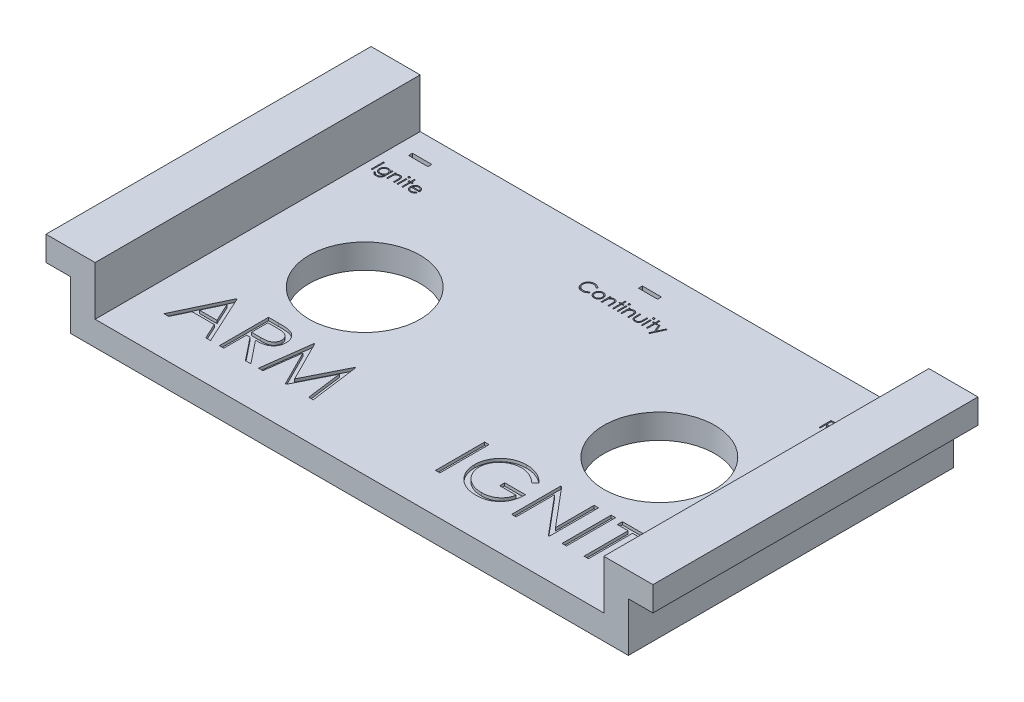
from build123d import *

# Parameters (mm, degrees)
IZIM1_W                     = 144.272
IZIM1_H                     = 84.074
Y_KSEKLIK_EKSTR_ZYON1_DEPTH = 6.35
IZIM2_W                     = 84.074
IZIM2_H                     = 12.7
Y_KSEKLIK_EKSTR_ZYON2_DEPTH = 6.35
IZIM3_W                     = 84.074
IZIM3_H                     = 12.7
Y_KSEKLIK_EKSTR_ZYON3_DEPTH = 6.35
IZIM6_W                     = 84.074
IZIM6_H                     = 6.35
Y_KSEKLIK_EKSTR_ZYON4_DEPTH = 6.35
IZIM4_W                     = 84.074
IZIM4_H                     = 6.35
Y_KSEKLIK_EKSTR_ZYON5_DEPTH = 6.35
IZIM7_R                     = 14.351
KES_EKSTR_ZYON1_DEPTH       = 6.35
IZIM8_R                     = 14.351
KES_EKSTR_ZYON2_DEPTH       = 6.35
IZIM9_W                     = 4
IZIM9_H                     = 1
KES_EKSTR_ZYON3_DEPTH       = 6.35
IZIM10_W                    = 4.922542764
IZIM10_H                    = 1
KES_EKSTR_ZYON4_DEPTH       = 6.35
IZIM11_W                    = 0.284935897
IZIM11_H                    = 2.320192308
KES_EKSTR_ZYON5_DEPTH       = 0.762
IZIM12_W                    = 0.284935897
IZIM12_H                    = 2.320192308
KES_EKSTR_ZYON6_DEPTH       = 0.762
KES_EKSTR_ZYON7_DEPTH       = 0.762
IZIM14_W                    = 1.139743589
IZIM14_H                    = 12.7
KES_EKSTR_ZYON8_DEPTH       = 0.762
IZIM15_W                    = 5
IZIM15_H                    = 1
KES_EKSTR_ZYON9_DEPTH       = 6.35
IZIM16_W                    = 0.284935898
IZIM16_H                    = 3.175
IZIM16_W_2                  = 0.284935897
IZIM16_H_2                  = 2.320192308
KES_EKSTR_ZYON10_DEPTH      = 0.762


with BuildPart() as part:
    # Çizim1 → Yükseklik-Ekstrüzyon1 (new body)
    with BuildSketch(Plane(origin=(0, 0, 0), x_dir=(1, 0, 0), z_dir=(0, 1, 0))):
        Rectangle(IZIM1_W, IZIM1_H)
    extrude(amount=Y_KSEKLIK_EKSTR_ZYON1_DEPTH)

    # Çizim2 → Yükseklik-Ekstrüzyon2 (add)
    with BuildSketch(Plane.ZY.offset(72.136)):
        with Locations((0, 12.7)):
            Rectangle(IZIM2_W, IZIM2_H)
    extrude(amount=-Y_KSEKLIK_EKSTR_ZYON2_DEPTH)

    # Çizim3 → Yükseklik-Ekstrüzyon3 (add)
    with BuildSketch(Plane(origin=(72.136, 0, 0), x_dir=(0, 0, -1), z_dir=(1, 0, 0))):
        with Locations((0, 12.7)):
            Rectangle(IZIM3_W, IZIM3_H)
    extrude(amount=-Y_KSEKLIK_EKSTR_ZYON3_DEPTH)

    # Çizim6 → Yükseklik-Ekstrüzyon4 (add)
    with BuildSketch(Plane.ZY.offset(72.136)):
        with Locations((0, 15.875)):
            Rectangle(IZIM6_W, IZIM6_H)
    extrude(amount=Y_KSEKLIK_EKSTR_ZYON4_DEPTH)

    # Çizim4 → Yükseklik-Ekstrüzyon5 (add)
    with BuildSketch(Plane(origin=(72.136, 0, 0), x_dir=(0, 0, -1), z_dir=(1, 0, 0))):
        with Locations((0, 15.875)):
            Rectangle(IZIM4_W, IZIM4_H)
    extrude(amount=Y_KSEKLIK_EKSTR_ZYON5_DEPTH)

    # Çizim7 → Kes-Ekstrüzyon1 (cut)
    with BuildSketch(Plane(origin=(0, 6.35, 0), x_dir=(1, 0, 0), z_dir=(0, 1, 0))):
        with Locations(Location((-38.1, 0, 0), (0, 0, 270))):
            Circle(IZIM7_R)
    extrude(amount=-KES_EKSTR_ZYON1_DEPTH, mode=Mode.SUBTRACT)

    # Çizim8 → Kes-Ekstrüzyon2 (cut)
    with BuildSketch(Plane(origin=(0, 6.35, 0), x_dir=(1, 0, 0), z_dir=(0, 1, 0))):
        with Locations(Location((38.1, 0, 0), (0, 0, 270))):
            Circle(IZIM8_R)
    extrude(amount=-KES_EKSTR_ZYON2_DEPTH, mode=Mode.SUBTRACT)

    # Çizim9 → Kes-Ekstrüzyon3 (cut)
    with BuildSketch(Plane(origin=(0, 6.35, 0), x_dir=(1, 0, 0), z_dir=(0, 1, 0))):
        with Locations((59.436, 35.687)):
            Rectangle(IZIM9_W, IZIM9_H)
    extrude(amount=-KES_EKSTR_ZYON3_DEPTH, mode=Mode.SUBTRACT)

    # Çizim10 → Kes-Ekstrüzyon4 (cut)
    with BuildSketch(Plane(origin=(0, 6.35, 0), x_dir=(1, 0, 0), z_dir=(0, 1, 0))):
        with Locations((0, 35.687)):
            Rectangle(IZIM10_W, IZIM10_H)
    extrude(amount=-KES_EKSTR_ZYON4_DEPTH, mode=Mode.SUBTRACT)

    # Çizim11 → Kes-Ekstrüzyon5 (cut)
    # profile 1 of 12: a face of its own
    with BuildSketch(Plane(origin=(0, 6.35, 0), x_dir=(1, 0, 0), z_dir=(0, 1, 0))):
        with BuildLine():
            Line((-7.736114872, 29.897407853), (-7.985433783, 29.706602564))
            add(Edge.make_bspline(
                [(-7.985433783, 29.706602564), (-8.003219124, 29.727798837), (-8.038550022, 29.76990561), (-8.09539087, 29.829032768), (-8.154628789, 29.884427684), (-8.216241135, 29.936354246), (-8.281336908, 29.982996598), (-8.348339203, 30.026785384), (-8.418368859, 30.066035404), (-8.515207932, 30.113626827), (-8.64188848, 30.16328941), (-8.801359513, 30.204930199), (-8.967830295, 30.23143798), (-9.081402403, 30.234308943), (-9.13916976, 30.235769231)],
                knots=[0, 0, 0, 0, 0.757959112, 1.505699292, 2.245454638, 2.979532153, 3.711538275, 4.438200793, 5.171680507, 5.909471876, 7.393775596, 8.890124382, 10.418191784, 12, 12, 12, 12], degree=3))
            add(Edge.make_bspline(
                [(-9.13916976, 30.235769231), (-9.170995324, 30.235402779), (-9.234351082, 30.234673277), (-9.328375054, 30.225049285), (-9.420643322, 30.211522687), (-9.511095867, 30.191451858), (-9.59961755, 30.166076696), (-9.686787087, 30.135755071), (-9.771342416, 30.098240323), (-9.854453247, 30.056776402), (-9.934081531, 30.009942934), (-10.009424324, 29.958858679), (-10.080206838, 29.904095284), (-10.146485065, 29.845447495), (-10.208326761, 29.783179431), (-10.265283821, 29.716627492), (-10.317159158, 29.646004449), (-10.364981031, 29.572241573), (-10.407809724, 29.495553719), (-10.443668972, 29.415657048), (-10.475423619, 29.333919754), (-10.500550789, 29.249418344), (-10.520439458, 29.162747406), (-10.534162409, 29.073674334), (-10.543676951, 28.982385211), (-10.544402826, 28.92050962), (-10.544768718, 28.889319912)],
                knots=[0, 0, 0, 0, 1.054917814, 2.100044995, 3.131103042, 4.146048494, 5.169673617, 6.183595914, 7.203665975, 8.234915748, 9.262203917, 10.264457458, 11.251630812, 12.227803204, 13.197192746, 14.159520551, 15.12972552, 16.100847026, 17.073214652, 18.039054194, 19.002613845, 19.979014051, 20.95965708, 21.949030935, 22.966165397, 24, 24, 24, 24], degree=3))
            add(Edge.make_bspline(
                [(-10.544768718, 28.889319912), (-10.543624068, 28.842392215), (-10.5413767, 28.750255905), (-10.521375711, 28.615299709), (-10.490981807, 28.486013097), (-10.445429105, 28.363204241), (-10.38925968, 28.245358801), (-10.318284268, 28.134470699), (-10.236082124, 28.028864244), (-10.141490329, 27.931035284), (-10.03770791, 27.841669262), (-9.926358019, 27.762974091), (-9.807717986, 27.697374162), (-9.683097758, 27.642785982), (-9.551538354, 27.600824522), (-9.413276355, 27.57128421), (-9.268612474, 27.552014518), (-9.169761661, 27.550169672), (-9.119453214, 27.549230769)],
                knots=[0, 0, 0, 0, 1.029171465, 2.020641659, 2.987623507, 3.938342917, 4.889210282, 5.84687017, 6.821220943, 7.821438502, 8.827599549, 9.822697543, 10.807740252, 11.797342354, 12.80366471, 13.83203677, 14.896651826, 16, 16, 16, 16], degree=3))
            add(Edge.make_bspline(
                [(-9.119453214, 27.549230769), (-9.064024346, 27.550762734), (-8.954927074, 27.553778006), (-8.794936079, 27.579322468), (-8.64177792, 27.620740722), (-8.495444359, 27.678705266), (-8.35634793, 27.754057348), (-8.22427096, 27.845404709), (-8.099101964, 27.953616268), (-8.023835158, 28.036241677), (-7.985433783, 28.078397436)],
                knots=[0, 0, 0, 0, 1.028121516, 2.023589091, 2.998037872, 3.967518031, 4.937445131, 5.927275754, 6.942489185, 8, 8, 8, 8], degree=3))
            Line((-7.985433783, 28.078397436), (-7.736114872, 27.8895002))
            add(Edge.make_bspline(
                [(-7.736114872, 27.8895002), (-7.756179158, 27.863611748), (-7.796211622, 27.811958846), (-7.861034251, 27.739140938), (-7.929321514, 27.670647992), (-8.001580622, 27.607032221), (-8.076980333, 27.54702067), (-8.156874502, 27.492318294), (-8.240212839, 27.442161564), (-8.326712973, 27.396235711), (-8.416283001, 27.355489351), (-8.508815595, 27.32060629), (-8.603911903, 27.290557283), (-8.701576271, 27.265835883), (-8.802011279, 27.246539972), (-8.904854495, 27.233640695), (-9.010327882, 27.224803387), (-9.081485457, 27.223997921), (-9.117545161, 27.223589744)],
                knots=[0, 0, 0, 0, 0.986787822, 1.968848986, 2.935600012, 3.899624008, 4.868462664, 5.837806735, 6.815139263, 7.798259679, 8.787526145, 9.778297419, 10.776456485, 11.791383307, 12.812564526, 13.85620153, 14.913611965, 16, 16, 16, 16], degree=3))
            add(Edge.make_bspline(
                [(-9.117545161, 27.223589744), (-9.151693344, 27.223827408), (-9.219217149, 27.224297361), (-9.318911017, 27.231910255), (-9.415965851, 27.242296803), (-9.510104261, 27.257936064), (-9.601839967, 27.276391287), (-9.690341354, 27.301130213), (-9.776479295, 27.328842671), (-9.859907719, 27.361413623), (-9.940697589, 27.398167589), (-10.018588332, 27.439707074), (-10.093544125, 27.485682766), (-10.166301899, 27.53508124), (-10.23578685, 27.589489221), (-10.30260112, 27.648151096), (-10.367119366, 27.710869149), (-10.407036087, 27.756094623), (-10.427105457, 27.778833133)],
                knots=[0, 0, 0, 0, 1.114604814, 2.203992996, 3.262667896, 4.300477797, 5.318619304, 6.316056647, 7.298880507, 8.271930387, 9.238335007, 10.195173496, 11.151986948, 12.108099108, 13.064862484, 14.031167946, 15.010108607, 16, 16, 16, 16], degree=3))
            add(Edge.make_bspline(
                [(-10.427105457, 27.778833133), (-10.459250648, 27.818331212), (-10.523152945, 27.896850513), (-10.604909815, 28.024109939), (-10.674893669, 28.156977528), (-10.73147754, 28.296151321), (-10.775712305, 28.441319022), (-10.806356675, 28.59255381), (-10.826269916, 28.749714444), (-10.828547106, 28.856609245), (-10.829704616, 28.910944511)],
                knots=[0, 0, 0, 0, 0.994628077, 1.977248131, 2.950237994, 3.925870899, 4.908910175, 5.911660606, 6.938484602, 8, 8, 8, 8], degree=3))
            add(Edge.make_bspline(
                [(-10.829704616, 28.910944511), (-10.828293833, 28.968054101), (-10.825518206, 29.080413654), (-10.801936306, 29.245308598), (-10.764000684, 29.403288795), (-10.710119221, 29.554059335), (-10.641806509, 29.698413232), (-10.557418081, 29.835247753), (-10.457934316, 29.965437993), (-10.344135451, 30.087008518), (-10.219342225, 30.198169216), (-10.085703016, 30.295964844), (-9.943479392, 30.377351447), (-9.794238198, 30.44538368), (-9.636861901, 30.497675443), (-9.471686274, 30.534281549), (-9.299021687, 30.557066361), (-9.181217915, 30.559946728), (-9.121361266, 30.561410256)],
                knots=[0, 0, 0, 0, 1.032925535, 2.032216505, 3.007276963, 3.968222605, 4.92396291, 5.891752235, 6.871517503, 7.883894988, 8.900124299, 9.891468569, 10.874487609, 11.85992873, 12.854644235, 13.869047385, 14.917252991, 16, 16, 16, 16], degree=3))
            add(Edge.make_bspline(
                [(-9.121361266, 30.561410256), (-9.084880996, 30.560972888), (-9.012671973, 30.560107162), (-8.905853495, 30.551665162), (-8.801856527, 30.537592104), (-8.700609422, 30.518436813), (-8.60161962, 30.494663028), (-8.505643688, 30.4636929), (-8.41211845, 30.42828119), (-8.321633755, 30.387497439), (-8.234623742, 30.341716895), (-8.15111551, 30.291447007), (-8.071772388, 30.236750098), (-7.996036076, 30.17809136), (-7.925173513, 30.11422981), (-7.857172743, 30.046921991), (-7.79434305, 29.974229165), (-7.755559795, 29.923061832), (-7.736114872, 29.897407853)],
                knots=[0, 0, 0, 0, 1.096760587, 2.17092713, 3.219439832, 4.250915756, 5.268269357, 6.278326846, 7.281116186, 8.274029601, 9.260640565, 10.235837813, 11.203064059, 12.156899882, 13.114053108, 14.069676657, 15.032185724, 16, 16, 16, 16], degree=3))
        make_face()
    # profile 2 of 12: a face of its own
    with BuildSketch(Plane(origin=(0, 6.35, 0), x_dir=(1, 0, 0), z_dir=(0, 1, 0))):
        with BuildLine():
            add(Edge.make_bspline(
                [(-6.045580016, 29.665897436), (-6.002045076, 29.664970435), (-5.916683697, 29.663152812), (-5.791672258, 29.643726379), (-5.672342028, 29.614019841), (-5.558235982, 29.572952067), (-5.450815485, 29.517904869), (-5.348515857, 29.452219298), (-5.25161757, 29.374402231), (-5.193539536, 29.314205983), (-5.164059584, 29.283650841)],
                knots=[0, 0, 0, 0, 1.054011418, 2.066658804, 3.057071809, 4.030435133, 4.997543892, 5.974964718, 6.972108034, 8, 8, 8, 8], degree=3))
            add(Edge.make_bspline(
                [(-5.164059584, 29.283650841), (-5.138675954, 29.254428154), (-5.088399938, 29.19654832), (-5.023933178, 29.102699299), (-4.968396477, 29.005507922), (-4.923889363, 28.903683562), (-4.88879652, 28.79811511), (-4.86388121, 28.688439714), (-4.849061276, 28.574899585), (-4.84706287, 28.49778896), (-4.84605077, 28.458735978)],
                knots=[0, 0, 0, 0, 1.025258237, 2.030674902, 3.01204498, 3.988269485, 4.97094183, 5.956517959, 6.965070386, 8, 8, 8, 8], degree=3))
            add(Edge.make_bspline(
                [(-4.84605077, 28.458735978), (-4.846940983, 28.41945664), (-4.848700086, 28.341838836), (-4.865340366, 28.227521268), (-4.891222137, 28.116673108), (-4.928262447, 28.009758435), (-4.975758732, 27.906450442), (-5.033716713, 27.807200351), (-5.102543108, 27.711812344), (-5.18056102, 27.621096391), (-5.26678665, 27.537488468), (-5.360327728, 27.464619252), (-5.45934603, 27.402188297), (-5.565158214, 27.351899549), (-5.676798006, 27.312248606), (-5.794506204, 27.284399306), (-5.918099946, 27.267561207), (-6.002488925, 27.265398966), (-6.045580016, 27.264294872)],
                knots=[0, 0, 0, 0, 0.998656419, 1.973391657, 2.932242238, 3.890759089, 4.846373663, 5.82037756, 6.809684879, 7.83454468, 8.860553229, 9.859544525, 10.845671541, 11.83227036, 12.833544569, 13.85385346, 14.904124723, 16, 16, 16, 16], degree=3))
            add(Edge.make_bspline(
                [(-6.045580016, 27.264294872), (-6.088882226, 27.265402671), (-6.173691792, 27.267572352), (-6.29772179, 27.284333887), (-6.415640944, 27.312235772), (-6.527426887, 27.352029854), (-6.633693998, 27.402189905), (-6.733286035, 27.464430509), (-6.826903101, 27.537510078), (-6.913146973, 27.621090535), (-6.991159993, 27.711813853), (-7.059987651, 27.807199959), (-7.117945304, 27.906450544), (-7.165441674, 28.009758408), (-7.202481962, 28.116673115), (-7.228363739, 28.227521266), (-7.245004018, 28.341838836), (-7.246763121, 28.41945664), (-7.247653334, 28.458735978)],
                knots=[0, 0, 0, 0, 1.099876186, 2.154163076, 3.173186993, 4.173200201, 5.163417411, 6.152872554, 7.150605724, 8.17532212, 9.198891216, 10.186952605, 11.159729845, 12.11414092, 13.071450619, 14.029093627, 15.002601286, 16, 16, 16, 16], degree=3))
            add(Edge.make_bspline(
                [(-7.247653334, 28.458735978), (-7.246634331, 28.497576701), (-7.24461688, 28.574474659), (-7.229811847, 28.68780135), (-7.204993728, 28.797291124), (-7.169858818, 28.902452092), (-7.124941466, 29.003830237), (-7.070185155, 29.101261763), (-7.005060796, 29.19468641), (-6.95498474, 29.25249144), (-6.92964452, 29.281742788)],
                knots=[0, 0, 0, 0, 1.031353054, 2.041901799, 3.029428768, 4.008703097, 4.981709435, 5.96992636, 6.972712378, 8, 8, 8, 8], degree=3))
            add(Edge.make_bspline(
                [(-6.92964452, 29.281742788), (-6.900209012, 29.312562912), (-6.842318907, 29.373176108), (-6.744938275, 29.450766326), (-6.642890309, 29.517818764), (-6.534282698, 29.571772189), (-6.420270391, 29.614261415), (-6.300328649, 29.64380299), (-6.174893003, 29.663082819), (-6.089113918, 29.66494988), (-6.045580016, 29.665897436)],
                knots=[0, 0, 0, 0, 1.027980169, 2.021703884, 2.998553061, 3.971491411, 4.943284454, 5.930300938, 6.949603206, 8, 8, 8, 8], degree=3))
        make_face()
        with BuildLine():
            add(Edge.make_bspline(
                [(-6.046852052, 29.380961538), (-6.077638313, 29.380086516), (-6.138416094, 29.37835906), (-6.227878146, 29.365220089), (-6.314002429, 29.344403425), (-6.396952337, 29.314826888), (-6.476448144, 29.276637172), (-6.552565959, 29.229730303), (-6.625529672, 29.174727549), (-6.693911973, 29.111714983), (-6.756670213, 29.042881895), (-6.811532377, 28.969540884), (-6.858182295, 28.892881555), (-6.897044439, 28.812824192), (-6.925988817, 28.728557503), (-6.947010059, 28.641035787), (-6.960136634, 28.550080731), (-6.961847849, 28.48824895), (-6.962717436, 28.456827925)],
                knots=[0, 0, 0, 0, 1.021534396, 2.016698045, 2.994645724, 3.958388632, 4.93408049, 5.916473867, 6.921342795, 7.962252576, 8.998418191, 10.008913653, 10.997312074, 11.973003931, 12.956656626, 13.948281152, 14.957379055, 16, 16, 16, 16], degree=3))
            add(Edge.make_bspline(
                [(-6.962717436, 28.456827925), (-6.961259818, 28.416231443), (-6.958366717, 28.335655018), (-6.934839753, 28.216990642), (-6.895482199, 28.103069962), (-6.842335167, 27.994560812), (-6.77574524, 27.894165246), (-6.697289115, 27.804656113), (-6.607808815, 27.727380413), (-6.50837099, 27.663262789), (-6.401006716, 27.612317867), (-6.287381339, 27.576214511), (-6.168871567, 27.55274519), (-6.087881189, 27.550412495), (-6.046852052, 27.549230769)],
                knots=[0, 0, 0, 0, 1.016792936, 2.018143844, 3.017858371, 4.030088057, 5.03801393, 6.028138512, 7.003788237, 7.991172063, 8.984598303, 9.972568034, 10.972917682, 12, 12, 12, 12], degree=3))
            add(Edge.make_bspline(
                [(-6.046852052, 27.549230769), (-6.005825274, 27.550419381), (-5.924839555, 27.552765666), (-5.806494445, 27.57609631), (-5.693179627, 27.612476059), (-5.585926869, 27.663205493), (-5.486534307, 27.727623898), (-5.396410461, 27.804219754), (-5.318624221, 27.894402319), (-5.252100165, 27.994693792), (-5.198082763, 28.10290174), (-5.15890943, 28.217011668), (-5.135325905, 28.335649663), (-5.132440439, 28.416229649), (-5.130986667, 28.456827925)],
                knots=[0, 0, 0, 0, 1.02726834, 2.027799167, 3.010890988, 4.004497153, 4.992059811, 5.971914811, 6.958719428, 7.966827853, 8.981595046, 9.981490638, 10.983022906, 12, 12, 12, 12], degree=3))
            add(Edge.make_bspline(
                [(-5.130986667, 28.456827925), (-5.131855955, 28.488249138), (-5.133566581, 28.550081288), (-5.146697441, 28.641033657), (-5.167702824, 28.728565319), (-5.196705648, 28.812795351), (-5.235398932, 28.893088837), (-5.282948451, 28.969315804), (-5.337586596, 29.043135956), (-5.401102127, 29.111492473), (-5.469413048, 29.174752114), (-5.542406333, 29.229751631), (-5.618411278, 29.276431021), (-5.697676135, 29.31515354), (-5.780636678, 29.344134341), (-5.866640288, 29.365340285), (-5.955720637, 29.378303535), (-6.016280627, 29.380069871), (-6.046852052, 29.380961538)],
                knots=[0, 0, 0, 0, 1.042956736, 2.052379634, 3.044323526, 4.02829302, 5.004299113, 5.996692471, 7.007513377, 8.048758398, 9.090003419, 10.095195979, 11.07790575, 12.047570684, 13.018257071, 13.989683339, 14.985167495, 16, 16, 16, 16], degree=3))
        make_face(mode=Mode.SUBTRACT)
    # profile 3 of 12: a face of its own
    with BuildSketch(Plane(origin=(0, 6.35, 0), x_dir=(1, 0, 0), z_dir=(0, 1, 0))):
        with BuildLine():
            Line((-4.276178975, 29.625192308), (-3.991243077, 29.625192308))
            Line((-3.991243077, 29.625192308), (-3.991243077, 29.206692708))
            add(Edge.make_bspline(
                [(-3.991243077, 29.206692708), (-3.960819651, 29.244650035), (-3.901781931, 29.318307553), (-3.803461858, 29.41511836), (-3.699554177, 29.494897243), (-3.590695216, 29.558491399), (-3.4767372, 29.606430838), (-3.358374769, 29.64105279), (-3.234899286, 29.661812599), (-3.150930118, 29.664525165), (-3.108450609, 29.665897436)],
                knots=[0, 0, 0, 0, 1.12780773, 2.188550248, 3.19190651, 4.159438251, 5.104880172, 6.052711206, 7.014878035, 8, 8, 8, 8], degree=3))
            add(Edge.make_bspline(
                [(-3.108450609, 29.665897436), (-3.065514963, 29.664314294), (-2.981479546, 29.661215704), (-2.859125876, 29.636707706), (-2.744850011, 29.594847367), (-2.639059414, 29.537504989), (-2.543694014, 29.466197688), (-2.459942184, 29.383123558), (-2.39066981, 29.287568682), (-2.344226488, 29.198919819), (-2.313632507, 29.120280699), (-2.294371744, 29.05292829), (-2.278015068, 28.97789111), (-2.263834839, 28.895395911), (-2.254239888, 28.804864696), (-2.246672238, 28.706668575), (-2.241248708, 28.600839357), (-2.241033527, 28.527645059), (-2.240922565, 28.489900841)],
                knots=[0, 0, 0, 0, 1.235846778, 2.418850247, 3.575807741, 4.728682307, 5.871620074, 6.994088408, 8.11269785, 9.256955736, 9.865816715, 10.540099792, 11.271859618, 12.076849838, 12.949306005, 13.892391288, 14.913166135, 16, 16, 16, 16], degree=3))
            Line((-2.240922565, 28.489900841), (-2.240922565, 27.305))
            Line((-2.240922565, 27.305), (-2.525858462, 27.305))
            Line((-2.525858462, 27.305), (-2.525858462, 28.39640625))
            add(Edge.make_bspline(
                [(-2.525858462, 28.39640625), (-2.526033729, 28.427995182), (-2.526368986, 28.488419433), (-2.527426394, 28.574932762), (-2.52997529, 28.653388443), (-2.533556974, 28.723598912), (-2.53879938, 28.78549675), (-2.544262767, 28.839208022), (-2.550943853, 28.884664536), (-2.556897353, 28.912028575), (-2.559567396, 28.924300881)],
                knots=[0, 0, 0, 0, 1.430800155, 2.736877192, 3.918605307, 4.986035426, 5.920637409, 6.731861385, 7.431261377, 8, 8, 8, 8], degree=3))
            add(Edge.make_bspline(
                [(-2.559567396, 28.924300881), (-2.569206271, 28.960324599), (-2.587758123, 29.02965911), (-2.633599665, 29.123706559), (-2.691488244, 29.203714915), (-2.762152721, 29.269189512), (-2.844910526, 29.320144486), (-2.939532005, 29.35549943), (-3.045104058, 29.377612189), (-3.119357676, 29.379813944), (-3.158059984, 29.380961538)],
                knots=[0, 0, 0, 0, 1.084156227, 2.086665306, 3.027808233, 3.945421172, 4.874247719, 5.839848303, 6.874090471, 8, 8, 8, 8], degree=3))
            add(Edge.make_bspline(
                [(-3.158059984, 29.380961538), (-3.180981383, 29.380529734), (-3.226342239, 29.379675205), (-3.293606856, 29.371101527), (-3.358852356, 29.3570785), (-3.422733546, 29.338147664), (-3.483972759, 29.312146892), (-3.544537509, 29.282638106), (-3.602147216, 29.245855085), (-3.658030298, 29.204860735), (-3.710021202, 29.15943174), (-3.758397623, 29.11149422), (-3.801521399, 29.060444208), (-3.84059084, 29.007104256), (-3.874316836, 28.950741803), (-3.903756423, 28.891900611), (-3.928735232, 28.830503233), (-3.941147388, 28.787890141), (-3.947357861, 28.76656851)],
                knots=[0, 0, 0, 0, 1.023777757, 2.026029729, 3.023749952, 4.003683103, 4.997618607, 5.993177895, 7.010360494, 8.046726602, 9.087585522, 10.09234134, 11.086953743, 12.070360549, 13.043493632, 14.017870808, 15.008233677, 16, 16, 16, 16], degree=3))
            add(Edge.make_bspline(
                [(-3.947357861, 28.76656851), (-3.950931685, 28.750915575), (-3.958711713, 28.716839956), (-3.967114741, 28.660919662), (-3.974741613, 28.596231327), (-3.981125139, 28.52285044), (-3.985030767, 28.440520082), (-3.989289256, 28.349591857), (-3.990839618, 28.249703193), (-3.991104825, 28.180160086), (-3.991243077, 28.143907252)],
                knots=[0, 0, 0, 0, 0.615963638, 1.340920617, 2.168419149, 3.115676021, 4.16674242, 5.331190069, 6.6087489, 8, 8, 8, 8], degree=3))
            Line((-3.991243077, 28.143907252), (-3.991243077, 27.305))
            Line((-3.991243077, 27.305), (-4.276178975, 27.305))
            Line((-4.276178975, 27.305), (-4.276178975, 29.625192308))
        make_face()
    # profile 4 of 12: a face of its own
    with BuildSketch(Plane(origin=(0, 6.35, 0), x_dir=(1, 0, 0), z_dir=(0, 1, 0))):
        Polygon((-1.304704616, 30.561410256), (-1.019768718, 30.561410256), (-1.019768718, 29.625192308), (-0.612717436, 29.625192308), (-0.612717436, 29.34025641), (-1.019768718, 29.34025641), (-1.019768718, 27.305), (-1.304704616, 27.305), (-1.304704616, 29.34025641), (-1.711755898, 29.34025641), (-1.711755898, 29.625192308), (-1.304704616, 29.625192308), align=None)
    # profile 5 of 12: a face of its own
    with BuildSketch(Plane(origin=(0, 6.35, 0), x_dir=(1, 0, 0), z_dir=(0, 1, 0))):
        with BuildLine():
            add(Edge.make_bspline(
                [(-0.023765113, 30.602115385), (-0.006083705, 30.601295189), (0.028539888, 30.599689089), (0.078608066, 30.585935463), (0.124198356, 30.562622177), (0.164636728, 30.531344181), (0.199336654, 30.494560043), (0.223630584, 30.451687593), (0.239244686, 30.405370114), (0.241130233, 30.37306214), (0.242090256, 30.35661258)],
                knots=[0, 0, 0, 0, 1.055194115, 2.066272739, 3.074728998, 4.095836921, 5.109056067, 6.073838105, 7.019297344, 8, 8, 8, 8], degree=3))
            add(Edge.make_bspline(
                [(0.242090256, 30.35661258), (0.241108582, 30.34059003), (0.23916793, 30.308915346), (0.223642644, 30.263400839), (0.199129614, 30.221124096), (0.164658979, 30.184411381), (0.12419246, 30.153150675), (0.078609633, 30.129832805), (0.028539476, 30.116080395), (-0.006083844, 30.114474127), (-0.023765113, 30.113653846)],
                knots=[0, 0, 0, 0, 0.96129708, 1.900370562, 2.859976407, 3.87933698, 4.906634145, 5.921202961, 6.938410037, 8, 8, 8, 8], degree=3))
            add(Edge.make_bspline(
                [(-0.023765113, 30.113653846), (-0.041244191, 30.114442807), (-0.075264933, 30.115978415), (-0.124583426, 30.130102646), (-0.169784984, 30.153158655), (-0.210302223, 30.184206694), (-0.244075326, 30.221349565), (-0.268657379, 30.263375039), (-0.284146808, 30.308921915), (-0.286092293, 30.340592237), (-0.287076411, 30.35661258)],
                knots=[0, 0, 0, 0, 1.054934014, 2.053291228, 3.073705704, 4.106921865, 5.123545215, 6.088680038, 7.033164197, 8, 8, 8, 8], degree=3))
            add(Edge.make_bspline(
                [(-0.287076411, 30.35661258), (-0.286113854, 30.373059851), (-0.284223331, 30.405363328), (-0.268645768, 30.451713822), (-0.244280085, 30.494332756), (-0.21027986, 30.531548745), (-0.169790935, 30.562614247), (-0.124581888, 30.585665637), (-0.075265339, 30.599791066), (-0.041244329, 30.601326509), (-0.023765113, 30.602115385)],
                knots=[0, 0, 0, 0, 0.98631895, 1.937192651, 2.907499808, 3.917963147, 4.944918757, 5.95915025, 6.951458133, 8, 8, 8, 8], degree=3))
        make_face()
    # profile 6 of 12: a face of its own
    with BuildSketch(Plane(origin=(0, 6.35, 0), x_dir=(1, 0, 0), z_dir=(0, 1, 0))):
        with Locations((-0.022493077, 28.465096154)):
            Rectangle(IZIM11_W, IZIM11_H)
    # profile 7 of 12: a face of its own
    with BuildSketch(Plane(origin=(0, 6.35, 0), x_dir=(1, 0, 0), z_dir=(0, 1, 0))):
        with BuildLine():
            Line((0.811962051, 29.625192308), (1.096897948, 29.625192308))
            Line((1.096897948, 29.625192308), (1.096897948, 29.206692708))
            add(Edge.make_bspline(
                [(1.096897948, 29.206692708), (1.127321374, 29.244650035), (1.186359094, 29.318307553), (1.284679168, 29.41511836), (1.388586849, 29.494897243), (1.497445809, 29.558491399), (1.611403826, 29.606430838), (1.729766256, 29.64105279), (1.85324174, 29.661812599), (1.937210907, 29.664525165), (1.979690416, 29.665897436)],
                knots=[0, 0, 0, 0, 1.12780773, 2.188550248, 3.19190651, 4.159438251, 5.104880172, 6.052711206, 7.014878035, 8, 8, 8, 8], degree=3))
            add(Edge.make_bspline(
                [(1.979690416, 29.665897436), (2.022626063, 29.664314294), (2.10666148, 29.661215704), (2.22901515, 29.636707706), (2.343291014, 29.594847367), (2.449081611, 29.537504989), (2.544447012, 29.466197688), (2.628198842, 29.383123558), (2.697471216, 29.287568682), (2.743914538, 29.198919819), (2.774508519, 29.120280699), (2.793769282, 29.05292829), (2.810125958, 28.97789111), (2.824306186, 28.895395911), (2.833901138, 28.804864696), (2.841468788, 28.706668575), (2.846892318, 28.600839357), (2.847107499, 28.527645059), (2.847218461, 28.489900841)],
                knots=[0, 0, 0, 0, 1.235846778, 2.418850247, 3.575807741, 4.728682307, 5.871620074, 6.994088408, 8.11269785, 9.256955736, 9.865816715, 10.540099792, 11.271859618, 12.076849838, 12.949306005, 13.892391288, 14.913166135, 16, 16, 16, 16], degree=3))
            Line((2.847218461, 28.489900841), (2.847218461, 27.305))
            Line((2.847218461, 27.305), (2.562282564, 27.305))
            Line((2.562282564, 27.305), (2.562282564, 28.39640625))
            add(Edge.make_bspline(
                [(2.562282564, 28.39640625), (2.562107296, 28.427995182), (2.56177204, 28.488419433), (2.560714632, 28.574932762), (2.558165736, 28.653388443), (2.554584052, 28.723598912), (2.549341646, 28.78549675), (2.543878259, 28.839208022), (2.537197173, 28.884664536), (2.531243673, 28.912028575), (2.528573629, 28.924300881)],
                knots=[0, 0, 0, 0, 1.430800155, 2.736877192, 3.918605307, 4.986035426, 5.920637409, 6.731861385, 7.431261377, 8, 8, 8, 8], degree=3))
            add(Edge.make_bspline(
                [(2.528573629, 28.924300881), (2.518934754, 28.960324599), (2.500382902, 29.02965911), (2.45454136, 29.123706559), (2.396652782, 29.203714915), (2.325988304, 29.269189512), (2.2432305, 29.320144486), (2.148609021, 29.35549943), (2.043036968, 29.377612189), (1.968783349, 29.379813944), (1.930081041, 29.380961538)],
                knots=[0, 0, 0, 0, 1.084156227, 2.086665306, 3.027808233, 3.945421172, 4.874247719, 5.839848303, 6.874090471, 8, 8, 8, 8], degree=3))
            add(Edge.make_bspline(
                [(1.930081041, 29.380961538), (1.907159643, 29.380529734), (1.861798787, 29.379675205), (1.794534169, 29.371101527), (1.729288669, 29.3570785), (1.66540748, 29.338147664), (1.604168267, 29.312146892), (1.543603517, 29.282638106), (1.48599381, 29.245855085), (1.430110728, 29.204860735), (1.378119824, 29.15943174), (1.329743403, 29.11149422), (1.286619627, 29.060444208), (1.247550186, 29.007104256), (1.21382419, 28.950741803), (1.184384603, 28.891900611), (1.159405794, 28.830503233), (1.146993637, 28.787890141), (1.140783165, 28.76656851)],
                knots=[0, 0, 0, 0, 1.023777757, 2.026029729, 3.023749952, 4.003683103, 4.997618607, 5.993177895, 7.010360494, 8.046726602, 9.087585522, 10.09234134, 11.086953743, 12.070360549, 13.043493632, 14.017870808, 15.008233677, 16, 16, 16, 16], degree=3))
            add(Edge.make_bspline(
                [(1.140783165, 28.76656851), (1.137209341, 28.750915575), (1.129429312, 28.716839956), (1.121026285, 28.660919662), (1.113399413, 28.596231327), (1.107015886, 28.52285044), (1.103110259, 28.440520082), (1.09885177, 28.349591857), (1.097301407, 28.249703193), (1.097036201, 28.180160086), (1.096897948, 28.143907252)],
                knots=[0, 0, 0, 0, 0.615963638, 1.340920617, 2.168419149, 3.115676021, 4.16674242, 5.331190069, 6.6087489, 8, 8, 8, 8], degree=3))
            Line((1.096897948, 28.143907252), (1.096897948, 27.305))
            Line((1.096897948, 27.305), (0.811962051, 27.305))
            Line((0.811962051, 27.305), (0.811962051, 29.625192308))
        make_face()
    # profile 8 of 12: a face of its own
    with BuildSketch(Plane(origin=(0, 6.35, 0), x_dir=(1, 0, 0), z_dir=(0, 1, 0))):
        with BuildLine():
            Line((3.457795384, 29.625192308), (3.742731282, 29.625192308))
            Line((3.742731282, 29.625192308), (3.742731282, 28.549050481))
            add(Edge.make_bspline(
                [(3.742731282, 28.549050481), (3.74286001, 28.517461273), (3.74310626, 28.457032597), (3.744776257, 28.370078249), (3.74870427, 28.290778803), (3.753615382, 28.219088448), (3.759931034, 28.155019315), (3.767445226, 28.098795184), (3.775843937, 28.04977846), (3.784065113, 28.020256987), (3.787888533, 28.006527444)],
                knots=[0, 0, 0, 0, 1.388932606, 2.656963016, 3.823490214, 4.879454478, 5.816252168, 6.653371382, 7.373723809, 8, 8, 8, 8], degree=3))
            add(Edge.make_bspline(
                [(3.787888533, 28.006527444), (3.794022139, 27.989270982), (3.806161834, 27.955116817), (3.828181351, 27.905778219), (3.855421342, 27.860080642), (3.8852299, 27.816261947), (3.919610077, 27.775620145), (3.958126883, 27.738223867), (3.999490998, 27.702660155), (4.060954484, 27.660582523), (4.145009675, 27.615483616), (4.255366103, 27.576570981), (4.375022079, 27.55331563), (4.457721503, 27.550617556), (4.500228277, 27.549230769)],
                knots=[0, 0, 0, 0, 0.725840625, 1.436591201, 2.137033971, 2.831655856, 3.53531722, 4.242432219, 4.957935707, 5.694543706, 7.190802206, 8.724350549, 10.316345118, 12, 12, 12, 12], degree=3))
            add(Edge.make_bspline(
                [(4.500228277, 27.549230769), (4.542731102, 27.550647045), (4.624966204, 27.553387276), (4.743307497, 27.575869486), (4.851485566, 27.613430361), (4.948414643, 27.665869942), (5.033655084, 27.730043099), (5.104688378, 27.805343946), (5.163296388, 27.889390176), (5.188886362, 27.952095772), (5.201755721, 27.983630809)],
                knots=[0, 0, 0, 0, 1.157059328, 2.238695713, 3.266970494, 4.264342957, 5.228770407, 6.160125903, 7.074715775, 8, 8, 8, 8], degree=3))
            add(Edge.make_bspline(
                [(5.201755721, 27.983630809), (5.205560487, 27.996300237), (5.213971895, 28.024309249), (5.223009171, 28.071825163), (5.231150289, 28.128489483), (5.238101885, 28.194673001), (5.243059568, 28.270202761), (5.245732035, 28.355055158), (5.248751256, 28.448963821), (5.248797082, 28.514702431), (5.248821025, 28.549050481)],
                knots=[0, 0, 0, 0, 0.557542046, 1.232589297, 2.036731608, 2.971723315, 4.038036528, 5.22795436, 6.551621927, 8, 8, 8, 8], degree=3))
            Line((5.248821025, 28.549050481), (5.248821025, 29.625192308))
            Line((5.248821025, 29.625192308), (5.533756923, 29.625192308))
            Line((5.533756923, 29.625192308), (5.533756923, 28.495625))
            add(Edge.make_bspline(
                [(5.533756923, 28.495625), (5.533356242, 28.457246352), (5.532578868, 28.382786524), (5.52758292, 28.274578794), (5.519010772, 28.173738758), (5.505999908, 28.080213037), (5.490700331, 27.994073036), (5.470964284, 27.915208352), (5.447398311, 27.843861971), (5.420814022, 27.778781931), (5.389407042, 27.719775105), (5.355999674, 27.6637719), (5.317423631, 27.612161881), (5.276810633, 27.562375942), (5.231633416, 27.516890413), (5.182738544, 27.474661575), (5.130814213, 27.435043896), (5.074708155, 27.399582521), (5.015239441, 27.367635993), (4.952334656, 27.33931855), (4.885223322, 27.316909784), (4.814771309, 27.297577966), (4.740633445, 27.282415554), (4.662881202, 27.271723455), (4.581540772, 27.265169047), (4.526105762, 27.264591157), (4.497684206, 27.264294872)],
                knots=[0, 0, 0, 0, 1.493040784, 2.896703357, 4.213163133, 5.428574705, 6.569057535, 7.615249723, 8.588095153, 9.490268104, 10.346124644, 11.18633936, 12.024365274, 12.850166724, 13.684164916, 14.514361689, 15.362232829, 16.222528818, 17.093394965, 17.986930858, 18.902426812, 19.842810585, 20.827885679, 21.843828298, 22.894529745, 24, 24, 24, 24], degree=3))
            add(Edge.make_bspline(
                [(4.497684206, 27.264294872), (4.469475226, 27.264603035), (4.414041953, 27.265208604), (4.332697324, 27.271687243), (4.25472966, 27.282398941), (4.180416155, 27.297689031), (4.109682238, 27.316774473), (4.042241391, 27.339456252), (3.978883302, 27.367650689), (3.91884677, 27.39938033), (3.862601746, 27.435271687), (3.809888965, 27.474612694), (3.760779106, 27.517344623), (3.715261337, 27.563289011), (3.673974565, 27.613015804), (3.636404299, 27.66612499), (3.601972145, 27.722090342), (3.570809257, 27.782019068), (3.544037878, 27.847852249), (3.520402048, 27.920693187), (3.501070255, 28.00134047), (3.485338158, 28.089725148), (3.472682209, 28.185424221), (3.463895494, 28.288991284), (3.458982562, 28.400174061), (3.458199642, 28.476963605), (3.457795384, 28.516613582)],
                knots=[0, 0, 0, 0, 1.083640291, 2.129454052, 3.13281866, 4.105697902, 5.042300162, 5.946461698, 6.836384745, 7.703652036, 8.553297018, 9.397182691, 10.228592656, 11.052265423, 11.879314572, 12.708807002, 13.549817954, 14.402308542, 15.300838682, 16.27712199, 17.341985831, 18.484375296, 19.725102775, 21.0496083, 22.476576903, 24, 24, 24, 24], degree=3))
            Line((3.457795384, 28.516613582), (3.457795384, 29.625192308))
        make_face()
    # profile 9 of 12: a face of its own
    with BuildSketch(Plane(origin=(0, 6.35, 0), x_dir=(1, 0, 0), z_dir=(0, 1, 0))):
        with BuildLine():
            add(Edge.make_bspline(
                [(6.285529759, 30.602115385), (6.303211167, 30.601295189), (6.33783476, 30.599689089), (6.387902938, 30.585935463), (6.433493228, 30.562622177), (6.4739316, 30.531344181), (6.508631525, 30.494560043), (6.532925456, 30.451687593), (6.548539558, 30.405370114), (6.550425104, 30.37306214), (6.551385128, 30.35661258)],
                knots=[0, 0, 0, 0, 1.055194115, 2.066272739, 3.074728998, 4.095836921, 5.109056067, 6.073838105, 7.019297344, 8, 8, 8, 8], degree=3))
            add(Edge.make_bspline(
                [(6.551385128, 30.35661258), (6.550403454, 30.34059003), (6.548462802, 30.308915346), (6.532937516, 30.263400839), (6.508424486, 30.221124096), (6.473953851, 30.184411381), (6.433487332, 30.153150675), (6.387904504, 30.129832805), (6.337834348, 30.116080395), (6.303211028, 30.114474127), (6.285529759, 30.113653846)],
                knots=[0, 0, 0, 0, 0.96129708, 1.900370562, 2.859976407, 3.87933698, 4.906634145, 5.921202961, 6.938410037, 8, 8, 8, 8], degree=3))
            add(Edge.make_bspline(
                [(6.285529759, 30.113653846), (6.268050681, 30.114442807), (6.234029939, 30.115978415), (6.184711446, 30.130102646), (6.139509888, 30.153158655), (6.098992649, 30.184206694), (6.065219545, 30.221349565), (6.040637493, 30.263375039), (6.025148063, 30.308921915), (6.023202579, 30.340592237), (6.022218461, 30.35661258)],
                knots=[0, 0, 0, 0, 1.054934014, 2.053291228, 3.073705704, 4.106921865, 5.123545215, 6.088680038, 7.033164197, 8, 8, 8, 8], degree=3))
            add(Edge.make_bspline(
                [(6.022218461, 30.35661258), (6.023181018, 30.373059851), (6.025071541, 30.405363328), (6.040649104, 30.451713822), (6.065014786, 30.494332756), (6.099015012, 30.531548745), (6.139503937, 30.562614247), (6.184712984, 30.585665637), (6.234029533, 30.599791066), (6.268050543, 30.601326509), (6.285529759, 30.602115385)],
                knots=[0, 0, 0, 0, 0.98631895, 1.937192651, 2.907499808, 3.917963147, 4.944918757, 5.95915025, 6.951458133, 8, 8, 8, 8], degree=3))
        make_face()
    # profile 10 of 12: a face of its own
    with BuildSketch(Plane(origin=(0, 6.35, 0), x_dir=(1, 0, 0), z_dir=(0, 1, 0))):
        with Locations((6.286801795, 28.465096154)):
            Rectangle(IZIM11_W, IZIM11_H)
    # profile 11 of 12: a face of its own
    with BuildSketch(Plane(origin=(0, 6.35, 0), x_dir=(1, 0, 0), z_dir=(0, 1, 0))):
        Polygon((7.40619282, 30.561410256), (7.691128717, 30.561410256), (7.691128717, 29.625192308), (8.09818, 29.625192308), (8.09818, 29.34025641), (7.691128717, 29.34025641), (7.691128717, 27.305), (7.40619282, 27.305), (7.40619282, 29.34025641), (6.999141538, 29.34025641), (6.999141538, 29.625192308), (7.40619282, 29.625192308), align=None)
    # profile 12 of 12: a face of its own
    with BuildSketch(Plane(origin=(0, 6.35, 0), x_dir=(1, 0, 0), z_dir=(0, 1, 0))):
        Polygon((8.342410769, 29.625192308), (8.649607283, 29.625192308), (9.435089054, 27.848159054), (10.23265516, 29.625192308), (10.540487692, 29.625192308), (9.115808205, 26.450192308), (8.807975673, 26.450192308), (9.28053677, 27.502801482), align=None)
    extrude(amount=-KES_EKSTR_ZYON5_DEPTH, mode=Mode.SUBTRACT)

    # Çizim12 → Kes-Ekstrüzyon6 (cut)
    # profile 1 of 6: a face of its own
    with BuildSketch(Plane(origin=(0, 6.35, 0), x_dir=(1, 0, 0), z_dir=(0, 1, 0))):
        with BuildLine():
            Line((52.066537523, 30.48), (52.701919133, 30.48))
            add(Edge.make_bspline(
                [(52.701919133, 30.48), (52.744320014, 30.479858861), (52.825734402, 30.479587859), (52.942368726, 30.478076774), (53.048347593, 30.473745752), (53.14361559, 30.47001868), (53.22817097, 30.463222418), (53.302273012, 30.456726689), (53.365580423, 30.448223439), (53.403903445, 30.440326377), (53.421255071, 30.436750801)],
                knots=[0, 0, 0, 0, 1.410062039, 2.707475311, 3.878576406, 4.937260626, 5.877586885, 6.699081471, 7.410979367, 8, 8, 8, 8], degree=3))
            add(Edge.make_bspline(
                [(53.421255071, 30.436750801), (53.444483937, 30.431011521), (53.490446134, 30.419655396), (53.556622266, 30.395652758), (53.619681688, 30.367876384), (53.679362457, 30.335252152), (53.735365639, 30.297537888), (53.788268679, 30.255384662), (53.838311635, 30.209023126), (53.883470685, 30.157284377), (53.92605111, 30.103004114), (53.96196365, 30.044308563), (53.992921242, 29.982929892), (54.017568783, 29.918243877), (54.03741523, 29.850877841), (54.051409033, 29.780221576), (54.059801182, 29.706596977), (54.060655579, 29.656379445), (54.061088805, 29.630916466)],
                knots=[0, 0, 0, 0, 1.027469482, 2.033020251, 3.019912614, 3.986113645, 4.951240523, 5.91722682, 6.890402269, 7.87763091, 8.8651537, 9.85103654, 10.82876324, 11.815024772, 12.821070561, 13.842952187, 14.906261191, 16, 16, 16, 16], degree=3))
            add(Edge.make_bspline(
                [(54.061088805, 29.630916466), (54.059756214, 29.588611764), (54.057155983, 29.506064333), (54.032912496, 29.386266248), (53.993200939, 29.274515941), (53.938479098, 29.17095412), (53.86879286, 29.077599463), (53.785041085, 28.995602407), (53.687177051, 28.926986201), (53.596073315, 28.879404013), (53.515596862, 28.848930446), (53.449345214, 28.827488892), (53.377075885, 28.810922681), (53.299481303, 28.796081704), (53.216238558, 28.784876953), (53.127547165, 28.776670399), (53.03334387, 28.771541369), (52.968629143, 28.770777551), (52.935337603, 28.770384615)],
                knots=[0, 0, 0, 0, 1.260483769, 2.459530307, 3.627416485, 4.787058657, 5.939039949, 7.08810263, 8.267026773, 9.491475466, 10.141966685, 10.831826277, 11.566392101, 12.351337768, 13.187381173, 14.07005841, 15.007169909, 16, 16, 16, 16], degree=3))
            Line((52.935337603, 28.770384615), (54.101793933, 27.305))
            Line((54.101793933, 27.305), (53.749440167, 27.305))
            Line((53.749440167, 27.305), (52.582983837, 28.770384615))
            Line((52.582983837, 28.770384615), (52.35147342, 28.770384615))
            Line((52.35147342, 28.770384615), (52.35147342, 27.305))
            Line((52.35147342, 27.305), (52.066537523, 27.305))
            Line((52.066537523, 27.305), (52.066537523, 30.48))
        make_face()
        with BuildLine():
            Line((52.35147342, 30.154358974), (52.35147342, 29.096025641))
            Line((52.35147342, 29.096025641), (52.932793532, 29.091573518))
            add(Edge.make_bspline(
                [(52.932793532, 29.091573518), (52.959935282, 29.09156151), (53.012543723, 29.091538236), (53.088653612, 29.095161162), (53.159519713, 29.0992826), (53.224870967, 29.10558665), (53.284736567, 29.113711086), (53.339086592, 29.123873793), (53.388009761, 29.135713879), (53.44506772, 29.154039639), (53.508782288, 29.18307367), (53.578025827, 29.225315229), (53.636992233, 29.278445788), (53.68681058, 29.33920028), (53.726842278, 29.405998877), (53.755065356, 29.478040869), (53.772974572, 29.553507533), (53.775086895, 29.605376245), (53.776152907, 29.631552484)],
                knots=[0, 0, 0, 0, 1.146690395, 2.22261258, 3.21895312, 4.145990853, 4.996080663, 5.770904154, 6.481378293, 7.121626537, 8.300444488, 9.431385265, 10.535395872, 11.636531494, 12.74115979, 13.810798291, 14.895190096, 16, 16, 16, 16], degree=3))
            add(Edge.make_bspline(
                [(53.776152907, 29.631552484), (53.775062412, 29.657085447), (53.772901447, 29.707682464), (53.755258636, 29.78175604), (53.725423269, 29.851666773), (53.685216667, 29.91713027), (53.636231719, 29.97655333), (53.578793418, 30.027396105), (53.514472276, 30.069350976), (53.454354832, 30.096161022), (53.400620939, 30.112598317), (53.353966891, 30.124165444), (53.301251479, 30.133458641), (53.242218741, 30.140904525), (53.177120691, 30.147304367), (53.105628171, 30.151614909), (53.028215521, 30.154167486), (52.974560805, 30.154293659), (52.94678592, 30.154358974)],
                knots=[0, 0, 0, 0, 1.101028733, 2.181837193, 3.264309656, 4.369019818, 5.486613113, 6.575447106, 7.666700264, 8.788928104, 9.402425223, 10.0903467, 10.862060571, 11.710948788, 12.657782767, 13.684531032, 14.801375019, 16, 16, 16, 16], degree=3))
            Line((52.94678592, 30.154358974), (52.35147342, 30.154358974))
        make_face(mode=Mode.SUBTRACT)
    # profile 2 of 6: a face of its own
    with BuildSketch(Plane(origin=(0, 6.35, 0), x_dir=(1, 0, 0), z_dir=(0, 1, 0))):
        with BuildLine():
            Line((57.032563164, 29.625192308), (57.032563164, 27.305))
            Line((57.032563164, 27.305), (56.747627266, 27.305))
            Line((56.747627266, 27.305), (56.747627266, 27.706327123))
            add(Edge.make_bspline(
                [(56.747627266, 27.706327123), (56.715497363, 27.670005492), (56.652795454, 27.599123371), (56.548073868, 27.506520257), (56.43706845, 27.429977066), (56.320317965, 27.368155356), (56.197927845, 27.321716848), (56.070169394, 27.288709404), (55.936990499, 27.267487853), (55.846047291, 27.265368748), (55.799961, 27.264294872)],
                knots=[0, 0, 0, 0, 1.074387032, 2.096679803, 3.090159297, 4.057316773, 5.018401886, 5.985159533, 6.978961417, 8, 8, 8, 8], degree=3))
            add(Edge.make_bspline(
                [(55.799961, 27.264294872), (55.758987213, 27.265407367), (55.678185092, 27.267601256), (55.559323, 27.284621345), (55.444939317, 27.311954124), (55.334925955, 27.349964216), (55.229994794, 27.400383962), (55.129247421, 27.460746379), (55.033205764, 27.532629132), (54.943333726, 27.614805415), (54.860573268, 27.704063725), (54.787946256, 27.799264328), (54.727391677, 27.899995561), (54.676754889, 28.004982065), (54.637751063, 28.115032028), (54.610560694, 28.229764887), (54.593560432, 28.349044987), (54.59136745, 28.430270126), (54.590255471, 28.47145633)],
                knots=[0, 0, 0, 0, 1.033919861, 2.038935746, 3.024066025, 3.998881131, 4.97069526, 5.957263378, 6.95902576, 7.993208707, 9.027059324, 10.027763471, 11.009749337, 11.988697705, 12.965288445, 13.950418724, 14.960734635, 16, 16, 16, 16], degree=3))
            add(Edge.make_bspline(
                [(54.590255471, 28.47145633), (54.591392095, 28.511791261), (54.59363914, 28.591531244), (54.610378846, 28.708805492), (54.638528404, 28.821761342), (54.678032523, 28.930035141), (54.728689154, 29.033757901), (54.790309633, 29.13300298), (54.86289841, 29.228043791), (54.946584522, 29.316645547), (55.037239635, 29.398488533), (55.134221127, 29.469616738), (55.235116532, 29.531045594), (55.341490834, 29.579716962), (55.451769565, 29.619095221), (55.566934477, 29.646339413), (55.686506409, 29.662393412), (55.767687069, 29.664718205), (55.808865247, 29.665897436)],
                knots=[0, 0, 0, 0, 1.020392517, 2.01726096, 2.990465484, 3.961182959, 4.928053699, 5.906110375, 6.912531644, 7.948652711, 8.985773172, 9.998621852, 10.987621588, 11.969261332, 12.953316658, 13.946091881, 14.958173133, 16, 16, 16, 16], degree=3))
            add(Edge.make_bspline(
                [(55.808865247, 29.665897436), (55.856217976, 29.66459319), (55.949074444, 29.662035625), (56.084899138, 29.640751579), (56.213390914, 29.604793827), (56.335541648, 29.555882954), (56.450912699, 29.490887321), (56.558411834, 29.408899785), (56.659164094, 29.310437423), (56.717566216, 29.234808519), (56.747627266, 29.195880409)],
                knots=[0, 0, 0, 0, 1.038897134, 2.037228247, 3.008116434, 3.962042015, 4.918381754, 5.904844433, 6.921570401, 8, 8, 8, 8], degree=3))
            Line((56.747627266, 29.195880409), (56.747627266, 29.625192308))
            Line((56.747627266, 29.625192308), (57.032563164, 29.625192308))
        make_face()
        with BuildLine():
            add(Edge.make_bspline(
                [(55.812681353, 29.380961538), (55.771030489, 29.379479596), (55.688818309, 29.376554476), (55.568128393, 29.35371852), (55.452636939, 29.315723209), (55.342921571, 29.263760342), (55.240715403, 29.198419988), (55.149371859, 29.119388447), (55.068143837, 29.028822013), (54.999828483, 28.927129384), (54.944138532, 28.818110687), (54.904979868, 28.704151376), (54.879154193, 28.58730686), (54.87651575, 28.508056424), (54.875191369, 28.468276242)],
                knots=[0, 0, 0, 0, 1.031046209, 2.035121221, 3.029706178, 4.034933723, 5.034054252, 6.02443088, 7.017295772, 8.038157696, 9.050218397, 10.03989886, 11.016116709, 12, 12, 12, 12], degree=3))
            add(Edge.make_bspline(
                [(54.875191369, 28.468276242), (54.876883093, 28.428733788), (54.880259912, 28.349803872), (54.904526613, 28.232800063), (54.94523907, 28.118813896), (55.000794369, 28.008812852), (55.070360093, 27.90668299), (55.1509948, 27.814390164), (55.243478269, 27.735024609), (55.34591965, 27.668587667), (55.455328309, 27.614918809), (55.570384804, 27.577575693), (55.688926276, 27.553465849), (55.769528036, 27.550649645), (55.810137282, 27.549230769)],
                knots=[0, 0, 0, 0, 0.979072187, 1.954306742, 2.945804271, 3.96968567, 4.997920485, 5.998718438, 6.996577872, 8.005894225, 9.015743152, 10.005417472, 10.995077863, 12, 12, 12, 12], degree=3))
            add(Edge.make_bspline(
                [(55.810137282, 27.549230769), (55.851363753, 27.550736594), (55.933359113, 27.553731529), (56.054407084, 27.576665248), (56.171877514, 27.614555515), (56.284170214, 27.667078295), (56.388778419, 27.732172467), (56.48266578, 27.8083789), (56.562055265, 27.897009646), (56.629358561, 27.994415428), (56.682131975, 28.101197025), (56.720573114, 28.214893041), (56.743300586, 28.335507434), (56.746165098, 28.417933996), (56.747627266, 28.460008013)],
                knots=[0, 0, 0, 0, 1.01762866, 2.023962475, 3.030623092, 4.058876274, 5.077231937, 6.066672613, 7.034107872, 8.005628644, 8.981990164, 9.965428785, 10.961468474, 12, 12, 12, 12], degree=3))
            add(Edge.make_bspline(
                [(56.747627266, 28.460008013), (56.746756721, 28.492064473), (56.745043212, 28.555161732), (56.731952624, 28.64780598), (56.711129226, 28.736464432), (56.681786629, 28.8212303), (56.643240964, 28.901634921), (56.596751919, 28.978255618), (56.541501976, 29.050693888), (56.47838053, 29.117952245), (56.40928781, 29.179299107), (56.336177049, 29.234058097), (56.258182042, 29.279042198), (56.176614445, 29.316272494), (56.091332734, 29.345899009), (56.001642957, 29.36566356), (55.908498448, 29.379234708), (55.844956669, 29.380379868), (55.812681353, 29.380961538)],
                knots=[0, 0, 0, 0, 1.050140795, 2.067009409, 3.05949893, 4.030605086, 5.00011959, 5.97591094, 6.962425594, 7.979863591, 8.993523472, 9.986985069, 10.967611495, 11.937549037, 12.921786183, 13.919465291, 14.943216303, 16, 16, 16, 16], degree=3))
        make_face(mode=Mode.SUBTRACT)
    # profile 3 of 6: a face of its own
    with BuildSketch(Plane(origin=(0, 6.35, 0), x_dir=(1, 0, 0), z_dir=(0, 1, 0))):
        with BuildLine():
            Line((60.044742651, 30.561410256), (60.044742651, 27.305))
            Line((60.044742651, 27.305), (59.759806753, 27.305))
            Line((59.759806753, 27.305), (59.759806753, 27.706327123))
            add(Edge.make_bspline(
                [(59.759806753, 27.706327123), (59.72767685, 27.670005492), (59.664974941, 27.599123371), (59.560253355, 27.506520257), (59.449247937, 27.429977066), (59.332497453, 27.368155356), (59.210107332, 27.321716848), (59.082348881, 27.288709404), (58.949169986, 27.267487853), (58.858226778, 27.265368748), (58.812140487, 27.264294872)],
                knots=[0, 0, 0, 0, 1.074387032, 2.096679803, 3.090159297, 4.057316773, 5.018401886, 5.985159533, 6.978961417, 8, 8, 8, 8], degree=3))
            add(Edge.make_bspline(
                [(58.812140487, 27.264294872), (58.771166701, 27.265407367), (58.690364579, 27.267601256), (58.571502488, 27.284621345), (58.457118804, 27.311954124), (58.347105442, 27.349964216), (58.242174281, 27.400383962), (58.141426908, 27.460746379), (58.045385252, 27.532629132), (57.955513213, 27.614805415), (57.872752755, 27.704063725), (57.800125744, 27.799264328), (57.739571164, 27.899995561), (57.688934377, 28.004982065), (57.64993055, 28.115032028), (57.622740182, 28.229764887), (57.605739919, 28.349044987), (57.603546937, 28.430270126), (57.602434958, 28.47145633)],
                knots=[0, 0, 0, 0, 1.033919861, 2.038935746, 3.024066025, 3.998881131, 4.97069526, 5.957263378, 6.95902576, 7.993208707, 9.027059324, 10.027763471, 11.009749337, 11.988697705, 12.965288445, 13.950418724, 14.960734635, 16, 16, 16, 16], degree=3))
            add(Edge.make_bspline(
                [(57.602434958, 28.47145633), (57.603571583, 28.511791261), (57.605818627, 28.591531244), (57.622558334, 28.708805492), (57.650707891, 28.821761342), (57.69021201, 28.930035141), (57.740868641, 29.033757901), (57.80248912, 29.13300298), (57.875077897, 29.228043791), (57.958764009, 29.316645547), (58.049419122, 29.398488533), (58.146400614, 29.469616738), (58.247296019, 29.531045594), (58.353670321, 29.579716962), (58.463949052, 29.619095221), (58.579113964, 29.646339413), (58.698685896, 29.662393412), (58.779866557, 29.664718205), (58.821044734, 29.665897436)],
                knots=[0, 0, 0, 0, 1.020392517, 2.01726096, 2.990465484, 3.961182959, 4.928053699, 5.906110375, 6.912531644, 7.948652711, 8.985773172, 9.998621852, 10.987621588, 11.969261332, 12.953316658, 13.946091881, 14.958173133, 16, 16, 16, 16], degree=3))
            add(Edge.make_bspline(
                [(58.821044734, 29.665897436), (58.868412838, 29.664475856), (58.961391163, 29.661685452), (59.097370536, 29.638366105), (59.225992154, 29.599211209), (59.347996507, 29.545606975), (59.462656244, 29.475937722), (59.570811839, 29.391798909), (59.670582425, 29.290809283), (59.729611864, 29.214961642), (59.759806753, 29.176163862)],
                knots=[0, 0, 0, 0, 1.031072012, 2.023879775, 2.993683497, 3.952812103, 4.918022106, 5.908088563, 6.929940113, 8, 8, 8, 8], degree=3))
            Line((59.759806753, 29.176163862), (59.759806753, 30.561410256))
            Line((59.759806753, 30.561410256), (60.044742651, 30.561410256))
        make_face()
        with BuildLine():
            add(Edge.make_bspline(
                [(58.82486084, 29.380961538), (58.783209976, 29.379479596), (58.700997796, 29.376554476), (58.58030788, 29.35371852), (58.464816426, 29.315723209), (58.355101059, 29.263760342), (58.252894891, 29.198419988), (58.161551346, 29.119388447), (58.080323324, 29.028822013), (58.01200797, 28.927129384), (57.95631802, 28.818110687), (57.917159355, 28.704151376), (57.891333681, 28.58730686), (57.888695237, 28.508056424), (57.887370856, 28.468276242)],
                knots=[0, 0, 0, 0, 1.031046209, 2.035121221, 3.029706178, 4.034933723, 5.034054252, 6.02443088, 7.017295772, 8.038157696, 9.050218397, 10.03989886, 11.016116709, 12, 12, 12, 12], degree=3))
            add(Edge.make_bspline(
                [(57.887370856, 28.468276242), (57.889062581, 28.428733788), (57.892439399, 28.349803872), (57.9167061, 28.232800063), (57.957418557, 28.118813896), (58.012973857, 28.008812852), (58.08253958, 27.90668299), (58.163174287, 27.814390164), (58.255657756, 27.735024609), (58.358099138, 27.668587667), (58.467507796, 27.614918809), (58.582564291, 27.577575693), (58.701105763, 27.553465849), (58.781707523, 27.550649645), (58.822316769, 27.549230769)],
                knots=[0, 0, 0, 0, 0.979072187, 1.954306742, 2.945804271, 3.96968567, 4.997920485, 5.998718438, 6.996577872, 8.005894225, 9.015743152, 10.005417472, 10.995077863, 12, 12, 12, 12], degree=3))
            add(Edge.make_bspline(
                [(58.822316769, 27.549230769), (58.86354324, 27.550736594), (58.9455386, 27.553731529), (59.066586571, 27.576665248), (59.184057002, 27.614555515), (59.296349702, 27.667078295), (59.400957906, 27.732172467), (59.494845267, 27.8083789), (59.574234752, 27.897009646), (59.641538048, 27.994415428), (59.694311462, 28.101197025), (59.732752601, 28.214893041), (59.755480073, 28.335507434), (59.758344585, 28.417933996), (59.759806753, 28.460008013)],
                knots=[0, 0, 0, 0, 1.01762866, 2.023962475, 3.030623092, 4.058876274, 5.077231937, 6.066672613, 7.034107872, 8.005628644, 8.981990164, 9.965428785, 10.961468474, 12, 12, 12, 12], degree=3))
            add(Edge.make_bspline(
                [(59.759806753, 28.460008013), (59.758936208, 28.492064473), (59.757222699, 28.555161732), (59.744132111, 28.64780598), (59.723308713, 28.736464432), (59.693966116, 28.8212303), (59.655420451, 28.901634921), (59.608931406, 28.978255618), (59.553681463, 29.050693888), (59.490560017, 29.117952245), (59.421467298, 29.179299107), (59.348356536, 29.234058097), (59.27036153, 29.279042198), (59.188793932, 29.316272494), (59.103512221, 29.345899009), (59.013822445, 29.36566356), (58.920677935, 29.379234708), (58.857136156, 29.380379868), (58.82486084, 29.380961538)],
                knots=[0, 0, 0, 0, 1.050140795, 2.067009409, 3.05949893, 4.030605086, 5.00011959, 5.97591094, 6.962425594, 7.979863591, 8.993523472, 9.986985069, 10.967611495, 11.937549037, 12.921786183, 13.919465291, 14.943216303, 16, 16, 16, 16], degree=3))
        make_face(mode=Mode.SUBTRACT)
    # profile 4 of 6: a face of its own
    with BuildSketch(Plane(origin=(0, 6.35, 0), x_dir=(1, 0, 0), z_dir=(0, 1, 0))):
        with BuildLine():
            add(Edge.make_bspline(
                [(60.796515487, 30.602115385), (60.814196895, 30.601295189), (60.848820488, 30.599689089), (60.898888666, 30.585935463), (60.944478956, 30.562622177), (60.984917328, 30.531344181), (61.019617254, 30.494560043), (61.043911184, 30.451687593), (61.059525286, 30.405370114), (61.061410833, 30.37306214), (61.062370856, 30.35661258)],
                knots=[0, 0, 0, 0, 1.055194115, 2.066272739, 3.074728998, 4.095836921, 5.109056067, 6.073838105, 7.019297344, 8, 8, 8, 8], degree=3))
            add(Edge.make_bspline(
                [(61.062370856, 30.35661258), (61.061389182, 30.34059003), (61.05944853, 30.308915346), (61.043923244, 30.263400839), (61.019410214, 30.221124096), (60.984939579, 30.184411381), (60.94447306, 30.153150675), (60.898890233, 30.129832805), (60.848820076, 30.116080395), (60.814196756, 30.114474127), (60.796515487, 30.113653846)],
                knots=[0, 0, 0, 0, 0.96129708, 1.900370562, 2.859976407, 3.87933698, 4.906634145, 5.921202961, 6.938410037, 8, 8, 8, 8], degree=3))
            add(Edge.make_bspline(
                [(60.796515487, 30.113653846), (60.779036409, 30.114442807), (60.745015667, 30.115978415), (60.695697174, 30.130102646), (60.650495616, 30.153158655), (60.609978377, 30.184206694), (60.576205274, 30.221349565), (60.551623221, 30.263375039), (60.536133792, 30.308921915), (60.534188307, 30.340592237), (60.533204189, 30.35661258)],
                knots=[0, 0, 0, 0, 1.054934014, 2.053291228, 3.073705704, 4.106921865, 5.123545215, 6.088680038, 7.033164197, 8, 8, 8, 8], degree=3))
            add(Edge.make_bspline(
                [(60.533204189, 30.35661258), (60.534166746, 30.373059851), (60.536057269, 30.405363328), (60.551634832, 30.451713822), (60.576000515, 30.494332756), (60.61000074, 30.531548745), (60.650489665, 30.562614247), (60.695698712, 30.585665637), (60.745015261, 30.599791066), (60.779036271, 30.601326509), (60.796515487, 30.602115385)],
                knots=[0, 0, 0, 0, 0.98631895, 1.937192651, 2.907499808, 3.917963147, 4.944918757, 5.95915025, 6.951458133, 8, 8, 8, 8], degree=3))
        make_face()
    # profile 5 of 6: a face of its own
    with BuildSketch(Plane(origin=(0, 6.35, 0), x_dir=(1, 0, 0), z_dir=(0, 1, 0))):
        with Locations((60.797787523, 28.465096154)):
            Rectangle(IZIM12_W, IZIM12_H)
    # profile 6 of 6: a face of its own
    with BuildSketch(Plane(origin=(0, 6.35, 0), x_dir=(1, 0, 0), z_dir=(0, 1, 0))):
        with BuildLine():
            add(Edge.make_bspline(
                [(62.752905712, 29.665897436), (62.796440652, 29.664970435), (62.881802031, 29.663152812), (63.00681347, 29.643726379), (63.126143701, 29.614019841), (63.240249746, 29.572952067), (63.347670243, 29.517904869), (63.449969871, 29.452219298), (63.546868158, 29.374402231), (63.604946192, 29.314205983), (63.634426144, 29.283650841)],
                knots=[0, 0, 0, 0, 1.054011418, 2.066658804, 3.057071809, 4.030435133, 4.997543892, 5.974964718, 6.972108034, 8, 8, 8, 8], degree=3))
            add(Edge.make_bspline(
                [(63.634426144, 29.283650841), (63.659809774, 29.254428154), (63.710085791, 29.19654832), (63.77455255, 29.102699299), (63.830089251, 29.005507922), (63.874596365, 28.903683562), (63.909689208, 28.79811511), (63.934604518, 28.688439714), (63.949424452, 28.574899585), (63.951422858, 28.49778896), (63.952434958, 28.458735978)],
                knots=[0, 0, 0, 0, 1.025258237, 2.030674902, 3.01204498, 3.988269485, 4.97094183, 5.956517959, 6.965070386, 8, 8, 8, 8], degree=3))
            add(Edge.make_bspline(
                [(63.952434958, 28.458735978), (63.951544745, 28.41945664), (63.949785643, 28.341838836), (63.933145362, 28.227521268), (63.907263591, 28.116673108), (63.870223281, 28.009758435), (63.822726996, 27.906450442), (63.764769015, 27.807200351), (63.69594262, 27.711812344), (63.617924708, 27.621096391), (63.531699078, 27.537488468), (63.438158001, 27.464619252), (63.339139698, 27.402188297), (63.233327514, 27.351899549), (63.121687722, 27.312248606), (63.003979525, 27.284399306), (62.880385782, 27.267561207), (62.795996803, 27.265398966), (62.752905712, 27.264294872)],
                knots=[0, 0, 0, 0, 0.998656419, 1.973391657, 2.932242238, 3.890759089, 4.846373663, 5.82037756, 6.809684879, 7.83454468, 8.860553229, 9.859544525, 10.845671541, 11.83227036, 12.833544569, 13.85385346, 14.904124723, 16, 16, 16, 16], degree=3))
            add(Edge.make_bspline(
                [(62.752905712, 27.264294872), (62.709603502, 27.265402671), (62.624793936, 27.267572352), (62.500763938, 27.284333887), (62.382844784, 27.312235772), (62.271058841, 27.352029854), (62.16479173, 27.402189905), (62.065199693, 27.464430509), (61.971582627, 27.537510078), (61.885338756, 27.621090535), (61.807325735, 27.711813853), (61.738498078, 27.807199959), (61.680540424, 27.906450544), (61.633044054, 28.009758408), (61.596003766, 28.116673115), (61.570121989, 28.227521266), (61.553481711, 28.341838836), (61.551722608, 28.41945664), (61.550832394, 28.458735978)],
                knots=[0, 0, 0, 0, 1.099876186, 2.154163076, 3.173186993, 4.173200201, 5.163417411, 6.152872554, 7.150605724, 8.17532212, 9.198891216, 10.186952605, 11.159729845, 12.11414092, 13.071450619, 14.029093627, 15.002601286, 16, 16, 16, 16], degree=3))
            add(Edge.make_bspline(
                [(61.550832394, 28.458735978), (61.551851397, 28.497576701), (61.553868848, 28.574474659), (61.568673881, 28.68780135), (61.593492, 28.797291124), (61.62862691, 28.902452092), (61.673544262, 29.003830237), (61.728300573, 29.101261763), (61.793424933, 29.19468641), (61.843500989, 29.25249144), (61.868841208, 29.281742788)],
                knots=[0, 0, 0, 0, 1.031353054, 2.041901799, 3.029428768, 4.008703097, 4.981709435, 5.96992636, 6.972712378, 8, 8, 8, 8], degree=3))
            add(Edge.make_bspline(
                [(61.868841208, 29.281742788), (61.898276716, 29.312562912), (61.956166821, 29.373176108), (62.053547453, 29.450766326), (62.155595419, 29.517818764), (62.264203031, 29.571772189), (62.378215337, 29.614261415), (62.498157079, 29.64380299), (62.623592725, 29.663082819), (62.70937181, 29.66494988), (62.752905712, 29.665897436)],
                knots=[0, 0, 0, 0, 1.027980169, 2.021703884, 2.998553061, 3.971491411, 4.943284454, 5.930300938, 6.949603206, 8, 8, 8, 8], degree=3))
        make_face()
        with BuildLine():
            add(Edge.make_bspline(
                [(62.751633676, 29.380961538), (62.720847415, 29.380086516), (62.660069634, 29.37835906), (62.570607582, 29.365220089), (62.484483299, 29.344403425), (62.401533391, 29.314826888), (62.322037584, 29.276637172), (62.245919769, 29.229730303), (62.172956056, 29.174727549), (62.104573756, 29.111714983), (62.041815515, 29.042881895), (61.986953351, 28.969540884), (61.940303433, 28.892881555), (61.901441289, 28.812824192), (61.872496911, 28.728557503), (61.851475669, 28.641035787), (61.838349094, 28.550080731), (61.836637879, 28.48824895), (61.835768292, 28.456827925)],
                knots=[0, 0, 0, 0, 1.021534396, 2.016698045, 2.994645724, 3.958388632, 4.93408049, 5.916473867, 6.921342795, 7.962252576, 8.998418191, 10.008913653, 10.997312074, 11.973003931, 12.956656626, 13.948281152, 14.957379055, 16, 16, 16, 16], degree=3))
            add(Edge.make_bspline(
                [(61.835768292, 28.456827925), (61.83722591, 28.416231443), (61.840119011, 28.335655018), (61.863645975, 28.216990642), (61.903003529, 28.103069962), (61.956150561, 27.994560812), (62.022740488, 27.894165246), (62.101196613, 27.804656113), (62.190676913, 27.727380413), (62.290114738, 27.663262789), (62.397479012, 27.612317867), (62.511104389, 27.576214511), (62.629614161, 27.55274519), (62.710604539, 27.550412495), (62.751633676, 27.549230769)],
                knots=[0, 0, 0, 0, 1.016792936, 2.018143844, 3.017858371, 4.030088057, 5.03801393, 6.028138512, 7.003788237, 7.991172063, 8.984598303, 9.972568034, 10.972917682, 12, 12, 12, 12], degree=3))
            add(Edge.make_bspline(
                [(62.751633676, 27.549230769), (62.792660454, 27.550419381), (62.873646173, 27.552765666), (62.991991284, 27.57609631), (63.105306101, 27.612476059), (63.21255886, 27.663205493), (63.311951421, 27.727623898), (63.402075267, 27.804219754), (63.479861507, 27.894402319), (63.546385563, 27.994693792), (63.600402965, 28.10290174), (63.639576298, 28.217011668), (63.663159823, 28.335649663), (63.666045289, 28.416229649), (63.667499061, 28.456827925)],
                knots=[0, 0, 0, 0, 1.02726834, 2.027799167, 3.010890988, 4.004497153, 4.992059811, 5.971914811, 6.958719428, 7.966827853, 8.981595046, 9.981490638, 10.983022906, 12, 12, 12, 12], degree=3))
            add(Edge.make_bspline(
                [(63.667499061, 28.456827925), (63.666629773, 28.488249138), (63.664919148, 28.550081288), (63.651788287, 28.641033657), (63.630782905, 28.728565319), (63.60178008, 28.812795351), (63.563086796, 28.893088837), (63.515537277, 28.969315804), (63.460899132, 29.043135956), (63.397383601, 29.111492473), (63.32907268, 29.174752114), (63.256079395, 29.229751631), (63.180074451, 29.276431021), (63.100809593, 29.31515354), (63.01784905, 29.344134341), (62.93184544, 29.365340285), (62.842765091, 29.378303535), (62.782205102, 29.380069871), (62.751633676, 29.380961538)],
                knots=[0, 0, 0, 0, 1.042956736, 2.052379634, 3.044323526, 4.02829302, 5.004299113, 5.996692471, 7.007513377, 8.048758398, 9.090003419, 10.095195979, 11.07790575, 12.047570684, 13.018257071, 13.989683339, 14.985167495, 16, 16, 16, 16], degree=3))
        make_face(mode=Mode.SUBTRACT)
    extrude(amount=-KES_EKSTR_ZYON6_DEPTH, mode=Mode.SUBTRACT)

    # Çizim13 → Kes-Ekstrüzyon7 (cut)
    # profile 1 of 3: a face of its own
    with BuildSketch(Plane(origin=(0, 6.35, 0), x_dir=(1, 0, 0), z_dir=(0, 1, 0))):
        Polygon((-51.940381325, -19.177), (-46.078842863, -31.877), (-47.317805203, -31.877), (-49.195329241, -27.806487179), (-54.952560812, -27.806487179), (-56.883510331, -31.877), (-58.127560812, -31.877), (-52.103201838, -19.177), align=None)
        Polygon((-52.034511934, -21.652380609), (-54.334351677, -26.503923077), (-49.795729882, -26.503923077), align=None, mode=Mode.SUBTRACT)
    # profile 2 of 3: a face of its own
    with BuildSketch(Plane(origin=(0, 6.35, 0), x_dir=(1, 0, 0), z_dir=(0, 1, 0))):
        with BuildLine():
            Line((-43.799355684, -19.177), (-41.257829241, -19.177))
            add(Edge.make_bspline(
                [(-41.257829241, -19.177), (-41.088225718, -19.177564555), (-40.762568165, -19.178648563), (-40.29603087, -19.184692902), (-39.872115404, -19.202016993), (-39.491043415, -19.216925282), (-39.152821896, -19.244110326), (-38.856413727, -19.270093246), (-38.603184082, -19.304106243), (-38.449891992, -19.335694492), (-38.380485491, -19.349996795)],
                knots=[0, 0, 0, 0, 1.410062039, 2.707475311, 3.878576406, 4.937260626, 5.877586885, 6.699081471, 7.410979367, 8, 8, 8, 8], degree=3))
            add(Edge.make_bspline(
                [(-38.380485491, -19.349996795), (-38.287570027, -19.372953915), (-38.103721236, -19.418378417), (-37.839016711, -19.514388969), (-37.586779021, -19.625494464), (-37.348055944, -19.755991392), (-37.124043216, -19.90684845), (-36.91243106, -20.075461351), (-36.712259236, -20.260907498), (-36.531623035, -20.467862494), (-36.361301333, -20.684983543), (-36.217651174, -20.919765747), (-36.093820805, -21.165280432), (-35.995230643, -21.424024491), (-35.915844854, -21.693488635), (-35.859869642, -21.976113697), (-35.826301047, -22.270612092), (-35.822883457, -22.471482219), (-35.821150556, -22.573334135)],
                knots=[0, 0, 0, 0, 1.027469482, 2.033020251, 3.019912614, 3.986113645, 4.951240523, 5.91722682, 6.890402269, 7.87763091, 8.8651537, 9.85103654, 10.82876324, 11.815024772, 12.821070561, 13.842952187, 14.906261191, 16, 16, 16, 16], degree=3))
            add(Edge.make_bspline(
                [(-35.821150556, -22.573334135), (-35.82648092, -22.742552943), (-35.836881842, -23.072742666), (-35.93385579, -23.551935007), (-36.092702018, -23.998936235), (-36.311589381, -24.413183521), (-36.590334336, -24.786602148), (-36.925341435, -25.114590372), (-37.316797568, -25.389055198), (-37.681212515, -25.579383946), (-38.003118325, -25.701278215), (-38.268124917, -25.787044431), (-38.557202236, -25.853309276), (-38.867580564, -25.912673183), (-39.200551542, -25.957492189), (-39.555317114, -25.990318403), (-39.932130293, -26.010834522), (-40.190989202, -26.013889797), (-40.324155363, -26.015461538)],
                knots=[0, 0, 0, 0, 1.260483769, 2.459530307, 3.627416485, 4.787058657, 5.939039949, 7.08810263, 8.267026773, 9.491475466, 10.141966685, 10.831826277, 11.566392101, 12.351337768, 13.187381173, 14.07005841, 15.007169909, 16, 16, 16, 16], degree=3))
            Line((-40.324155363, -26.015461538), (-35.658330043, -31.877))
            Line((-35.658330043, -31.877), (-37.067745107, -31.877))
            Line((-37.067745107, -31.877), (-41.733570427, -26.015461538))
            Line((-41.733570427, -26.015461538), (-42.659612094, -26.015461538))
            Line((-42.659612094, -26.015461538), (-42.659612094, -31.877))
            Line((-42.659612094, -31.877), (-43.799355684, -31.877))
            Line((-43.799355684, -31.877), (-43.799355684, -19.177))
        make_face()
        with BuildLine():
            Line((-42.659612094, -20.479564103), (-42.659612094, -24.712897436))
            Line((-42.659612094, -24.712897436), (-40.334331645, -24.730705929))
            add(Edge.make_bspline(
                [(-40.334331645, -24.730705929), (-40.225764647, -24.73075396), (-40.015330883, -24.730847056), (-39.710891327, -24.716355353), (-39.427426922, -24.699869599), (-39.166021907, -24.674653402), (-38.926559505, -24.642155656), (-38.709159406, -24.601504827), (-38.513466732, -24.554144486), (-38.285234892, -24.480841444), (-38.030376621, -24.36470532), (-37.753402467, -24.195739082), (-37.517536841, -23.98321685), (-37.318263455, -23.740198881), (-37.158136661, -23.473004492), (-37.04524435, -23.184836524), (-36.973607488, -22.882969868), (-36.965158194, -22.67549502), (-36.960894145, -22.570790064)],
                knots=[0, 0, 0, 0, 1.146690395, 2.22261258, 3.21895312, 4.145990853, 4.996080663, 5.770904154, 6.481378293, 7.121626537, 8.300444488, 9.431385265, 10.535395872, 11.636531494, 12.74115979, 13.810798291, 14.895190096, 16, 16, 16, 16], degree=3))
            add(Edge.make_bspline(
                [(-36.960894145, -22.570790064), (-36.965256128, -22.468658211), (-36.973899985, -22.266270145), (-37.04447123, -21.969975842), (-37.1638127, -21.690332908), (-37.324639106, -21.42847892), (-37.520578897, -21.190786678), (-37.750332103, -20.98741558), (-38.007616668, -20.819596094), (-38.248086445, -20.712355913), (-38.463022016, -20.646606732), (-38.649638211, -20.600338223), (-38.860499859, -20.563165436), (-39.096630809, -20.533381901), (-39.357023012, -20.507782531), (-39.642993089, -20.490540363), (-39.952643691, -20.480330056), (-40.167262556, -20.479825362), (-40.278362094, -20.479564103)],
                knots=[0, 0, 0, 0, 1.101028733, 2.181837193, 3.264309656, 4.369019818, 5.486613113, 6.575447106, 7.666700264, 8.788928104, 9.402425223, 10.0903467, 10.862060571, 11.710948788, 12.657782767, 13.684531032, 14.801375019, 16, 16, 16, 16], degree=3))
            Line((-40.278362094, -20.479564103), (-42.659612094, -20.479564103))
        make_face(mode=Mode.SUBTRACT)
    # profile 3 of 3: a face of its own
    with BuildSketch(Plane(origin=(0, 6.35, 0), x_dir=(1, 0, 0), z_dir=(0, 1, 0))):
        Polygon((-33.704483889, -31.877), (-32.027941421, -19.177), (-31.865120908, -19.177), (-26.621791581, -29.597512821), (-21.391182607, -19.177), (-21.225818024, -19.177), (-19.539099274, -31.877), (-20.683931004, -31.877), (-21.899996709, -22.738698718), (-26.484411774, -31.877), (-26.741362895, -31.877), (-31.343586453, -22.718346154), (-32.557108088, -31.877), align=None)
    extrude(amount=-KES_EKSTR_ZYON7_DEPTH, mode=Mode.SUBTRACT)

    # Çizim14 → Kes-Ekstrüzyon8 (cut)
    with BuildSketch(Plane(origin=(0, 6.35, 0), x_dir=(1, 0, 0), z_dir=(0, 1, 0))):
        with Locations((12.656118397, -25.527)):
            Rectangle(IZIM14_W, IZIM14_H)
        with BuildLine():
            Line((28.368297884, -21.344548077), (27.391374807, -22.270589744))
            add(Edge.make_bspline(
                [(27.391374807, -22.270589744), (27.214594841, -22.104289184), (26.86525033, -21.775653595), (26.295708878, -21.349256556), (25.701480835, -20.983982421), (25.085666917, -20.686779792), (24.463517307, -20.449642632), (23.843290033, -20.280811952), (23.23134706, -20.17314303), (22.824340296, -20.160267518), (22.623786666, -20.153923077)],
                knots=[0, 0, 0, 0, 1.08915593, 2.152340314, 3.188132944, 4.216796309, 5.218260357, 6.173443236, 7.099959455, 8, 8, 8, 8], degree=3))
            add(Edge.make_bspline(
                [(22.623786666, -20.153923077), (22.500724755, -20.155423875), (22.254920099, -20.15842158), (21.889806187, -20.196682018), (21.528521533, -20.251708811), (21.171748145, -20.331326481), (20.818792334, -20.43223364), (20.470881668, -20.558455178), (20.127367152, -20.705612779), (19.791484515, -20.875656612), (19.465854688, -21.062454912), (19.158308456, -21.269459616), (18.866885552, -21.490036082), (18.597063437, -21.729706779), (18.347290045, -21.986300719), (18.111620239, -22.255044716), (17.898342622, -22.54328108), (17.705697538, -22.845706637), (17.533842522, -23.157009724), (17.382136837, -23.474194001), (17.254784545, -23.796207416), (17.154021093, -24.12345404), (17.070888149, -24.453402181), (17.01240426, -24.788336452), (16.97943244, -25.128615482), (16.973729124, -25.35647982), (16.970861986, -25.471030449)],
                knots=[0, 0, 0, 0, 1.02818874, 2.053710826, 3.065248034, 4.081641283, 5.106893873, 6.131558223, 7.173050175, 8.228653731, 9.27666206, 10.308777013, 11.325269123, 12.329503258, 13.32196095, 14.316845687, 15.314881793, 16.315733098, 17.311955233, 18.285320748, 19.252783886, 20.203351036, 21.145449891, 22.095197417, 23.042428769, 24, 24, 24, 24], degree=3))
            add(Edge.make_bspline(
                [(16.970861986, -25.471030449), (16.973604164, -25.588127414), (16.979081032, -25.822001592), (17.014134191, -26.171048655), (17.079188092, -26.514911687), (17.166156636, -26.854720627), (17.274944167, -27.191057441), (17.410553555, -27.522463977), (17.571174448, -27.848927968), (17.757089937, -28.167507892), (17.96096559, -28.477834291), (18.189359055, -28.77015027), (18.431967458, -29.048348404), (18.697629323, -29.30625189), (18.977825948, -29.550759171), (19.280928778, -29.775133779), (19.600977706, -29.983697618), (19.938461018, -30.173822131), (20.289716828, -30.343670246), (20.649877046, -30.494705526), (21.020092263, -30.61909055), (21.39841688, -30.720465956), (21.784399894, -30.80356132), (22.18000055, -30.857019178), (22.582310092, -30.895811621), (22.853504557, -30.898647967), (22.99013282, -30.900076923)],
                knots=[0, 0, 0, 0, 0.93586088, 1.869166235, 2.799637598, 3.729985548, 4.670839027, 5.622275134, 6.589130586, 7.576015415, 8.568469353, 9.55398029, 10.53834874, 11.515998671, 12.510579167, 13.508179873, 14.527009472, 15.561807829, 16.601455013, 17.643573243, 18.680854198, 19.719860599, 20.772568776, 21.833555941, 22.908541556, 24, 24, 24, 24], degree=3))
            add(Edge.make_bspline(
                [(22.99013282, -30.900076923), (23.154791394, -30.896634946), (23.478125256, -30.889876065), (23.95341892, -30.83726073), (24.409904348, -30.755085221), (24.846298857, -30.634740396), (25.263109303, -30.48123849), (25.66186369, -30.296198087), (26.039422566, -30.072521844), (26.396920938, -29.820068098), (26.726239869, -29.538799992), (27.023253405, -29.235290111), (27.28322418, -28.911011698), (27.510026946, -28.567874697), (27.697655492, -28.203038876), (27.851662205, -27.818292149), (27.969711578, -27.413461463), (28.018171058, -27.133728971), (28.042656858, -26.992384615)],
                knots=[0, 0, 0, 0, 1.13008108, 2.219097802, 3.278683437, 4.311054135, 5.322181354, 6.324827112, 7.324222904, 8.330512327, 9.32562643, 10.293043162, 11.24128371, 12.174520618, 13.111833804, 14.052305215, 15.015860969, 16, 16, 16, 16], degree=3))
            Line((28.042656858, -26.992384615), (23.809323525, -26.992384615))
            Line((23.809323525, -26.992384615), (23.809323525, -25.689820513))
            Line((23.809323525, -25.689820513), (29.182400448, -25.689820513))
            add(Edge.make_bspline(
                [(29.182400448, -25.689820513), (29.176210655, -25.932599115), (29.164096113, -26.407760695), (29.079118905, -27.100709964), (28.941898989, -27.755201537), (28.754445857, -28.371924682), (28.511784126, -28.950005433), (28.216518094, -29.490030719), (27.863922112, -29.988511818), (27.466555652, -30.449518203), (27.020604377, -30.860741344), (26.538118242, -31.222168604), (26.018300099, -31.526615237), (25.461641655, -31.774303927), (24.869965225, -31.967612422), (24.241901676, -32.104669286), (23.578302725, -32.186783725), (23.12350964, -32.197275301), (22.89091407, -32.202641026)],
                knots=[0, 0, 0, 0, 1.140356446, 2.231883559, 3.274166699, 4.278491846, 5.25512956, 6.21435461, 7.1637429, 8.11826594, 9.068280886, 10.0076534, 10.945064095, 11.891975133, 12.864533718, 13.863980011, 14.907571808, 16, 16, 16, 16], degree=3))
            add(Edge.make_bspline(
                [(22.89091407, -32.202641026), (22.747548721, -32.200575929), (22.464786049, -32.196502892), (22.047170395, -32.167556517), (21.641069315, -32.122995568), (21.246541968, -32.055703263), (20.862137127, -31.973281518), (20.489774633, -31.867738281), (20.128036026, -31.745569001), (19.776362192, -31.606610414), (19.437945123, -31.445604689), (19.111277475, -31.26668114), (18.794553533, -31.070762374), (18.489930735, -30.854460162), (18.19582188, -30.619392378), (17.914123384, -30.365087872), (17.643258227, -30.092324095), (17.473584545, -29.898634545), (17.38808955, -29.801038462)],
                knots=[0, 0, 0, 0, 1.107784379, 2.184907829, 3.233506516, 4.263428166, 5.276301166, 6.270063455, 7.25232949, 8.225834625, 9.190232166, 10.146266622, 11.1027726, 12.066435141, 13.031522626, 14.010570082, 14.99756817, 16, 16, 16, 16], degree=3))
            add(Edge.make_bspline(
                [(17.38808955, -29.801038462), (17.264043455, -29.646204949), (17.0180103, -29.339108001), (16.701315275, -28.847073917), (16.43134447, -28.337615739), (16.212295516, -27.80931523), (16.041251602, -27.262666544), (15.918583199, -26.698368201), (15.846711036, -26.115693542), (15.836356771, -25.721393867), (15.831118397, -25.521911859)],
                knots=[0, 0, 0, 0, 1.023165419, 2.029347347, 3.013907458, 3.994755782, 4.975994455, 5.96558838, 6.970761222, 8, 8, 8, 8], degree=3))
            add(Edge.make_bspline(
                [(15.831118397, -25.521911859), (15.833049661, -25.372537171), (15.836887644, -25.075686255), (15.883425945, -24.634969739), (15.950196805, -24.202078656), (16.048338974, -23.777366867), (16.172059706, -23.360550719), (16.32646807, -22.951436679), (16.506245264, -22.549783316), (16.71519835, -22.158355281), (16.947733388, -21.782346697), (17.200101331, -21.423271239), (17.475885823, -21.087668061), (17.770583153, -20.771286937), (18.087709374, -20.47810255), (18.424293569, -20.205400491), (18.780595127, -19.952814959), (19.15773498, -19.724324416), (19.550084007, -19.519079279), (19.956701726, -19.339141282), (20.377464015, -19.190430395), (20.809218576, -19.064251251), (21.255233507, -18.970942027), (21.712272169, -18.903273722), (22.182716862, -18.856970975), (22.500710454, -18.853247133), (22.661947724, -18.851358974)],
                knots=[0, 0, 0, 0, 1.008945113, 2.00506715, 2.99143336, 3.967273523, 4.948097931, 5.927297278, 6.919902385, 7.919676788, 8.923139349, 9.905703106, 10.883022732, 11.856032218, 12.825136022, 13.798837087, 14.781400844, 15.773989409, 16.776158564, 17.77167057, 18.775803737, 19.789618931, 20.80898985, 21.851988756, 22.910860228, 24, 24, 24, 24], degree=3))
            add(Edge.make_bspline(
                [(22.661947724, -18.851358974), (22.793440779, -18.853461702), (23.054176056, -18.857631162), (23.442163713, -18.886531457), (23.824154367, -18.932338111), (24.20071441, -18.994846737), (24.57056151, -19.079986414), (24.93474927, -19.181870475), (25.293805616, -19.300495089), (25.646605263, -19.441968902), (25.995520404, -19.602546341), (26.342491082, -19.783297903), (26.686331775, -19.987314348), (27.027638764, -20.215201463), (27.368564306, -20.463045293), (27.703716008, -20.737934339), (28.041183834, -21.029028339), (28.258178989, -21.238332263), (28.368297884, -21.344548077)],
                knots=[0, 0, 0, 0, 0.985871117, 1.954866573, 2.915460327, 3.869826059, 4.81536089, 5.759505086, 6.70452669, 7.649098992, 8.607881297, 9.583363685, 10.581137262, 11.603961102, 12.659522466, 13.73993555, 14.853081303, 16, 16, 16, 16], degree=3))
        make_face()
        Polygon((31.787528653, -31.877), (31.787528653, -19.177), (32.026671281, -19.177), (40.417015832, -29.172653045), (40.417015832, -19.177), (41.556759422, -19.177), (41.556759422, -31.877), (41.29726423, -31.877), (32.927272243, -21.90424359), (32.927272243, -31.877), align=None)
        with Locations((45.383041474, -25.527)):
            Rectangle(IZIM14_W, IZIM14_H)
        Polygon((47.743938909, -20.479564103), (47.743938909, -19.177), (54.419579935, -19.177), (54.419579935, -20.479564103), (51.651631217, -20.479564103), (51.651631217, -31.877), (50.511887627, -31.877), (50.511887627, -20.479564103), align=None)
        Polygon((56.373426089, -19.177), (63.537528653, -19.177), (63.537528653, -20.479564103), (57.513169679, -20.479564103), (57.513169679, -24.38725641), (63.537528653, -24.38725641), (63.537528653, -25.689820513), (57.513169679, -25.689820513), (57.513169679, -30.574435897), (63.537528653, -30.574435897), (63.537528653, -31.877), (56.373426089, -31.877), align=None)
    extrude(amount=-KES_EKSTR_ZYON8_DEPTH, mode=Mode.SUBTRACT)

    # Çizim15 → Kes-Ekstrüzyon9 (cut)
    with BuildSketch(Plane(origin=(0, 6.35, 0), x_dir=(1, 0, 0), z_dir=(0, 1, 0))):
        with Locations((-59.436, 35.687)):
            Rectangle(IZIM15_W, IZIM15_H)
    extrude(amount=-KES_EKSTR_ZYON9_DEPTH, mode=Mode.SUBTRACT)

    # Çizim16 → Kes-Ekstrüzyon10 (cut)
    # profile 1 of 7: a face of its own
    with BuildSketch(Plane(origin=(0, 6.35, 0), x_dir=(1, 0, 0), z_dir=(0, 1, 0))):
        with Locations((-63.587540436, 28.8925)):
            Rectangle(IZIM16_W, IZIM16_H)
    # profile 2 of 7: a face of its own
    with BuildSketch(Plane(origin=(0, 6.35, 0), x_dir=(1, 0, 0), z_dir=(0, 1, 0))):
        with BuildLine():
            Line((-60.677123769, 29.625192308), (-60.392187872, 29.625192308))
            Line((-60.392187872, 29.625192308), (-60.392187872, 27.783921274))
            add(Edge.make_bspline(
                [(-60.392187872, 27.783921274), (-60.392439189, 27.744698599), (-60.392924292, 27.668989388), (-60.396417673, 27.559516949), (-60.403784287, 27.458401285), (-60.412137877, 27.365181236), (-60.424154541, 27.280288894), (-60.438828817, 27.203470944), (-60.455371183, 27.134653669), (-60.469903809, 27.092267564), (-60.476778216, 27.072217548)],
                knots=[0, 0, 0, 0, 1.307562039, 2.523909702, 3.650326591, 4.686913197, 5.643429486, 6.506965704, 7.293745905, 8, 8, 8, 8], degree=3))
            add(Edge.make_bspline(
                [(-60.476778216, 27.072217548), (-60.486928454, 27.046155405), (-60.506925445, 26.99481036), (-60.544377412, 26.922026369), (-60.586318168, 26.853495001), (-60.634221434, 26.78959817), (-60.687870592, 26.730656642), (-60.74600166, 26.675389872), (-60.809746762, 26.624967091), (-60.879069451, 26.580258286), (-60.952371704, 26.539992887), (-61.029611383, 26.505116358), (-61.110352937, 26.474739007), (-61.195354846, 26.451985328), (-61.283284416, 26.432268831), (-61.375175657, 26.419437581), (-61.470491694, 26.410704464), (-61.53530286, 26.409896895), (-61.568184466, 26.409487179)],
                knots=[0, 0, 0, 0, 0.981931301, 1.934503488, 2.87077864, 3.801706999, 4.735015492, 5.667491629, 6.616593066, 7.585388521, 8.561939025, 9.551802639, 10.560317337, 11.588439944, 12.640189604, 13.723962949, 14.845264515, 16, 16, 16, 16], degree=3))
            add(Edge.make_bspline(
                [(-61.568184466, 26.409487179), (-61.616158476, 26.410264134), (-61.709864605, 26.411781736), (-61.846484848, 26.429462781), (-61.976237773, 26.454458533), (-62.097408887, 26.492291314), (-62.209232475, 26.538589155), (-62.310944848, 26.591743148), (-62.401632924, 26.652693449), (-62.48338797, 26.722090423), (-62.557176412, 26.804607477), (-62.626597597, 26.901852143), (-62.693418594, 27.015305678), (-62.732578716, 27.098574782), (-62.753085308, 27.142179487)],
                knots=[0, 0, 0, 0, 1.157897085, 2.2616841, 3.32207898, 4.345638746, 5.321241055, 6.241986252, 7.112515963, 7.955008012, 8.825025602, 9.77857164, 10.836726669, 12, 12, 12, 12], degree=3))
            Line((-62.753085308, 27.142179487), (-62.46814941, 27.142179487))
            add(Edge.make_bspline(
                [(-62.46814941, 27.142179487), (-62.445232977, 27.105797728), (-62.400434173, 27.03467587), (-62.316660909, 26.942588936), (-62.224852312, 26.863891241), (-62.121910028, 26.800472181), (-62.007405726, 26.752656871), (-61.881270518, 26.718570709), (-61.742478004, 26.698163381), (-61.645850767, 26.69570385), (-61.595533224, 26.694423077)],
                knots=[0, 0, 0, 0, 0.997731894, 1.950442991, 2.880492273, 3.800895997, 4.748200782, 5.754801363, 6.83083817, 8, 8, 8, 8], degree=3))
            add(Edge.make_bspline(
                [(-61.595533224, 26.694423077), (-61.545851831, 26.695720426), (-61.450071077, 26.698221586), (-61.312338517, 26.718579816), (-61.186613109, 26.752664289), (-61.073619212, 26.80038761), (-60.974690051, 26.858853336), (-60.889407745, 26.92416769), (-60.820333646, 26.997810457), (-60.773876169, 27.065648238), (-60.744997623, 27.126085841), (-60.726607808, 27.178112839), (-60.711663564, 27.236943664), (-60.699163283, 27.302381081), (-60.68884824, 27.374518585), (-60.682314197, 27.453521115), (-60.677591782, 27.539209124), (-60.677283381, 27.598620756), (-60.677123769, 27.62936899)],
                knots=[0, 0, 0, 0, 1.570740765, 3.028230971, 4.391408896, 5.680370741, 6.894727393, 8.017376726, 9.065722033, 10.075533815, 10.603371122, 11.180248986, 11.817768598, 12.521299649, 13.286540596, 14.121245857, 15.027658897, 16, 16, 16, 16], degree=3))
            Line((-60.677123769, 27.62936899), (-60.677123769, 27.749576322))
            add(Edge.make_bspline(
                [(-60.677123769, 27.749576322), (-60.706044497, 27.715157687), (-60.763377246, 27.646925831), (-60.862389464, 27.557516346), (-60.970536238, 27.480512499), (-61.087633451, 27.417358452), (-61.210812785, 27.366847446), (-61.338740094, 27.331520617), (-61.470268602, 27.308696993), (-61.559397337, 27.306241071), (-61.604437471, 27.305)],
                knots=[0, 0, 0, 0, 1.012485704, 2.007162095, 2.997754123, 3.998611389, 4.999708251, 5.992315798, 6.98544096, 8, 8, 8, 8], degree=3))
            add(Edge.make_bspline(
                [(-61.604437471, 27.305), (-61.630958944, 27.305467203), (-61.683688036, 27.306396079), (-61.762024128, 27.31452297), (-61.83920424, 27.326314686), (-61.915048371, 27.343624277), (-61.989665963, 27.365841772), (-62.062933707, 27.393615528), (-62.135444835, 27.425016385), (-62.2058813, 27.462003142), (-62.273541576, 27.503153235), (-62.337915323, 27.547729229), (-62.398665355, 27.595497819), (-62.455213456, 27.646930043), (-62.507485451, 27.701951462), (-62.556184388, 27.759975542), (-62.600504981, 27.821812515), (-62.641356699, 27.886334826), (-62.676787477, 27.953972236), (-62.7078883, 28.023258079), (-62.734929689, 28.094044209), (-62.756488303, 28.166567616), (-62.772953956, 28.240782578), (-62.785209662, 28.316567514), (-62.792161035, 28.394155794), (-62.793245002, 28.446426589), (-62.793790436, 28.472728365)],
                knots=[0, 0, 0, 0, 1.028754217, 2.045334182, 3.052854819, 4.056607503, 5.061168794, 6.071104265, 7.095078842, 8.125279047, 9.155117945, 10.165957491, 11.161587969, 12.151493252, 13.128948131, 14.104219989, 15.088194871, 16.07871515, 17.064853787, 18.047899887, 19.02414258, 20.002704429, 20.980574569, 21.971845993, 22.979467364, 24, 24, 24, 24], degree=3))
            add(Edge.make_bspline(
                [(-62.793790436, 28.472728365), (-62.793319478, 28.499038317), (-62.792379386, 28.551556317), (-62.784259569, 28.629461188), (-62.772676997, 28.70632289), (-62.754345664, 28.781349176), (-62.732281661, 28.855394486), (-62.704955278, 28.9279119), (-62.672099689, 28.998923505), (-62.634897987, 29.068481887), (-62.593093132, 29.135653652), (-62.547252953, 29.199449967), (-62.49732211, 29.25940138), (-62.443989443, 29.316112705), (-62.386603752, 29.369036774), (-62.325194723, 29.418045135), (-62.260367682, 29.463959288), (-62.191921712, 29.505788858), (-62.120912939, 29.542784181), (-62.049145404, 29.576541323), (-61.975668434, 29.603332988), (-61.901851916, 29.626939657), (-61.82639585, 29.643663013), (-61.750225429, 29.656564618), (-61.673079879, 29.664424758), (-61.621415468, 29.66540591), (-61.595533224, 29.665897436)],
                knots=[0, 0, 0, 0, 1.008818848, 2.013730394, 3.001654427, 3.987803273, 4.973046549, 5.963777569, 6.957074694, 7.972068341, 8.987420212, 9.989399531, 10.982630087, 11.977756091, 12.973280677, 13.973972381, 14.989194003, 16.018387222, 17.047741039, 18.059210846, 19.057554164, 20.045176975, 21.029480261, 22.018708529, 23.007435371, 24, 24, 24, 24], degree=3))
            add(Edge.make_bspline(
                [(-61.595533224, 29.665897436), (-61.552851301, 29.664666739), (-61.468567617, 29.662236492), (-61.344533065, 29.64316731), (-61.224842605, 29.612765312), (-61.108820833, 29.569208276), (-60.995522636, 29.509745027), (-60.88532142, 29.431419638), (-60.777898348, 29.333529545), (-60.711606316, 29.258460875), (-60.677123769, 29.219413061)],
                knots=[0, 0, 0, 0, 0.96728863, 1.910097829, 2.838038873, 3.762875196, 4.71315279, 5.730631239, 6.819562287, 8, 8, 8, 8], degree=3))
            Line((-60.677123769, 29.219413061), (-60.677123769, 29.625192308))
        make_face()
        with BuildLine():
            add(Edge.make_bspline(
                [(-61.57263659, 29.380961538), (-61.6143023, 29.379545429), (-61.69679157, 29.376741833), (-61.817703138, 29.352807129), (-61.934431499, 29.315300491), (-62.044744995, 29.26164969), (-62.148075016, 29.196249917), (-62.239764317, 29.117019799), (-62.319960206, 29.026535749), (-62.387799014, 28.925615882), (-62.441802468, 28.816738532), (-62.48003257, 28.701975223), (-62.504752234, 28.583180337), (-62.507480604, 28.502106618), (-62.508854538, 28.461280048)],
                knots=[0, 0, 0, 0, 1.026226791, 2.031711442, 3.026614839, 4.04107745, 5.047145931, 6.032893242, 7.017642609, 8.019221815, 9.021877557, 10.003543541, 10.994637589, 12, 12, 12, 12], degree=3))
            add(Edge.make_bspline(
                [(-62.508854538, 28.461280048), (-62.508196173, 28.430497722), (-62.506901362, 28.369957889), (-62.494452116, 28.281114227), (-62.474330812, 28.196495657), (-62.445812775, 28.11609706), (-62.410477116, 28.039457282), (-62.366034037, 27.967104262), (-62.313736369, 27.898973564), (-62.253993448, 27.835569103), (-62.188156302, 27.77781951), (-62.116746743, 27.727075716), (-62.039861623, 27.685573277), (-61.959391874, 27.649704088), (-61.873384974, 27.623506648), (-61.783079732, 27.603514327), (-61.687837264, 27.592076383), (-61.622911472, 27.590658702), (-61.589809066, 27.589935897)],
                knots=[0, 0, 0, 0, 1.039728707, 2.044842319, 3.024901384, 3.974314358, 4.923051295, 5.871625912, 6.837440708, 7.820715446, 8.810779094, 9.792721783, 10.773906224, 11.758876063, 12.764959493, 13.806266761, 14.881525401, 16, 16, 16, 16], degree=3))
            add(Edge.make_bspline(
                [(-61.589809066, 27.589935897), (-61.556277656, 27.590632228), (-61.490707341, 27.591993896), (-61.39493942, 27.603699213), (-61.304195434, 27.62258772), (-61.218558588, 27.649405607), (-61.137705543, 27.683624624), (-61.062544571, 27.726928556), (-60.991464079, 27.776244862), (-60.926733622, 27.833768618), (-60.868200986, 27.897164292), (-60.817191647, 27.966147875), (-60.773726397, 28.039681346), (-60.737733082, 28.117756415), (-60.710254633, 28.200979835), (-60.691822483, 28.289143558), (-60.678934936, 28.3818252), (-60.677736669, 28.445333016), (-60.677123769, 28.477816506)],
                knots=[0, 0, 0, 0, 1.121943988, 2.193949579, 3.223793937, 4.220241907, 5.192961521, 6.155822191, 7.11847367, 8.083710714, 9.04790392, 10.001595906, 10.949595423, 11.902125208, 12.873731292, 13.87582262, 14.913508608, 16, 16, 16, 16], degree=3))
            add(Edge.make_bspline(
                [(-60.677123769, 28.477816506), (-60.678338949, 28.52010556), (-60.680712983, 28.602723509), (-60.703116833, 28.723107506), (-60.739239452, 28.836290517), (-60.789900435, 28.941914581), (-60.853384114, 29.03886053), (-60.929847956, 29.125332874), (-61.017973283, 29.201442937), (-61.117506903, 29.264850584), (-61.224592799, 29.316072799), (-61.33664417, 29.354500978), (-61.45349466, 29.37626725), (-61.532694046, 29.37938777), (-61.57263659, 29.380961538)],
                knots=[0, 0, 0, 0, 1.070913519, 2.092188694, 3.091357305, 4.074328408, 5.051968682, 6.018948707, 6.99050112, 7.9935919, 9.000589572, 9.992915277, 10.987769056, 12, 12, 12, 12], degree=3))
        make_face(mode=Mode.SUBTRACT)
    # profile 3 of 7: a face of its own
    with BuildSketch(Plane(origin=(0, 6.35, 0), x_dir=(1, 0, 0), z_dir=(0, 1, 0))):
        with BuildLine():
            Line((-59.74090582, 29.625192308), (-59.455969923, 29.625192308))
            Line((-59.455969923, 29.625192308), (-59.455969923, 29.206692708))
            add(Edge.make_bspline(
                [(-59.455969923, 29.206692708), (-59.425546497, 29.244650035), (-59.366508777, 29.318307553), (-59.268188703, 29.41511836), (-59.164281022, 29.494897243), (-59.055422062, 29.558491399), (-58.941464046, 29.606430838), (-58.823101615, 29.64105279), (-58.699626132, 29.661812599), (-58.615656964, 29.664525165), (-58.573177455, 29.665897436)],
                knots=[0, 0, 0, 0, 1.12780773, 2.188550248, 3.19190651, 4.159438251, 5.104880172, 6.052711206, 7.014878035, 8, 8, 8, 8], degree=3))
            add(Edge.make_bspline(
                [(-58.573177455, 29.665897436), (-58.530241808, 29.664314294), (-58.446206391, 29.661215704), (-58.323852721, 29.636707706), (-58.209576857, 29.594847367), (-58.10378626, 29.537504989), (-58.008420859, 29.466197688), (-57.92466903, 29.383123558), (-57.855396655, 29.287568682), (-57.808953333, 29.198919819), (-57.778359353, 29.120280699), (-57.759098589, 29.05292829), (-57.742741913, 28.97789111), (-57.728561685, 28.895395911), (-57.718966733, 28.804864696), (-57.711399083, 28.706668575), (-57.705975553, 28.600839357), (-57.705760373, 28.527645059), (-57.70564941, 28.489900841)],
                knots=[0, 0, 0, 0, 1.235846778, 2.418850247, 3.575807741, 4.728682307, 5.871620074, 6.994088408, 8.11269785, 9.256955736, 9.865816715, 10.540099792, 11.271859618, 12.076849838, 12.949306005, 13.892391288, 14.913166135, 16, 16, 16, 16], degree=3))
            Line((-57.70564941, 28.489900841), (-57.70564941, 27.305))
            Line((-57.70564941, 27.305), (-57.990585308, 27.305))
            Line((-57.990585308, 27.305), (-57.990585308, 28.39640625))
            add(Edge.make_bspline(
                [(-57.990585308, 28.39640625), (-57.990760575, 28.427995182), (-57.991095831, 28.488419433), (-57.992153239, 28.574932762), (-57.994702135, 28.653388443), (-57.998283819, 28.723598912), (-58.003526226, 28.78549675), (-58.008989613, 28.839208022), (-58.015670699, 28.884664536), (-58.021624198, 28.912028575), (-58.024294242, 28.924300881)],
                knots=[0, 0, 0, 0, 1.430800155, 2.736877192, 3.918605307, 4.986035426, 5.920637409, 6.731861385, 7.431261377, 8, 8, 8, 8], degree=3))
            add(Edge.make_bspline(
                [(-58.024294242, 28.924300881), (-58.033933117, 28.960324599), (-58.052484969, 29.02965911), (-58.098326511, 29.123706559), (-58.156215089, 29.203714915), (-58.226879567, 29.269189512), (-58.309637371, 29.320144486), (-58.404258851, 29.35549943), (-58.509830903, 29.377612189), (-58.584084522, 29.379813944), (-58.62278683, 29.380961538)],
                knots=[0, 0, 0, 0, 1.084156227, 2.086665306, 3.027808233, 3.945421172, 4.874247719, 5.839848303, 6.874090471, 8, 8, 8, 8], degree=3))
            add(Edge.make_bspline(
                [(-58.62278683, 29.380961538), (-58.645708229, 29.380529734), (-58.691069085, 29.379675205), (-58.758333702, 29.371101527), (-58.823579202, 29.3570785), (-58.887460391, 29.338147664), (-58.948699604, 29.312146892), (-59.009264354, 29.282638106), (-59.066874062, 29.245855085), (-59.122757143, 29.204860735), (-59.174748047, 29.15943174), (-59.223124469, 29.11149422), (-59.266248244, 29.060444208), (-59.305317685, 29.007104256), (-59.339043681, 28.950741803), (-59.368483268, 28.891900611), (-59.393462077, 28.830503233), (-59.405874234, 28.787890141), (-59.412084707, 28.76656851)],
                knots=[0, 0, 0, 0, 1.023777757, 2.026029729, 3.023749952, 4.003683103, 4.997618607, 5.993177895, 7.010360494, 8.046726602, 9.087585522, 10.09234134, 11.086953743, 12.070360549, 13.043493632, 14.017870808, 15.008233677, 16, 16, 16, 16], degree=3))
            add(Edge.make_bspline(
                [(-59.412084707, 28.76656851), (-59.415658531, 28.750915575), (-59.423438559, 28.716839956), (-59.431841586, 28.660919662), (-59.439468458, 28.596231327), (-59.445851985, 28.52285044), (-59.449757613, 28.440520082), (-59.454016101, 28.349591857), (-59.455566464, 28.249703193), (-59.455831671, 28.180160086), (-59.455969923, 28.143907252)],
                knots=[0, 0, 0, 0, 0.615963638, 1.340920617, 2.168419149, 3.115676021, 4.16674242, 5.331190069, 6.6087489, 8, 8, 8, 8], degree=3))
            Line((-59.455969923, 28.143907252), (-59.455969923, 27.305))
            Line((-59.455969923, 27.305), (-59.74090582, 27.305))
            Line((-59.74090582, 27.305), (-59.74090582, 29.625192308))
        make_face()
    # profile 4 of 7: a face of its own
    with BuildSketch(Plane(origin=(0, 6.35, 0), x_dir=(1, 0, 0), z_dir=(0, 1, 0))):
        with BuildLine():
            add(Edge.make_bspline(
                [(-56.953876574, 30.602115385), (-56.936195166, 30.601295189), (-56.901571573, 30.599689089), (-56.851503395, 30.585935463), (-56.805913105, 30.562622177), (-56.765474733, 30.531344181), (-56.730774807, 30.494560043), (-56.706480877, 30.451687593), (-56.690866775, 30.405370114), (-56.688981228, 30.37306214), (-56.688021205, 30.35661258)],
                knots=[0, 0, 0, 0, 1.055194115, 2.066272739, 3.074728998, 4.095836921, 5.109056067, 6.073838105, 7.019297344, 8, 8, 8, 8], degree=3))
            add(Edge.make_bspline(
                [(-56.688021205, 30.35661258), (-56.689002879, 30.34059003), (-56.690943531, 30.308915346), (-56.706468817, 30.263400839), (-56.730981847, 30.221124096), (-56.765452482, 30.184411381), (-56.805919001, 30.153150675), (-56.851501828, 30.129832805), (-56.901571985, 30.116080395), (-56.936195305, 30.114474127), (-56.953876574, 30.113653846)],
                knots=[0, 0, 0, 0, 0.96129708, 1.900370562, 2.859976407, 3.87933698, 4.906634145, 5.921202961, 6.938410037, 8, 8, 8, 8], degree=3))
            add(Edge.make_bspline(
                [(-56.953876574, 30.113653846), (-56.971355652, 30.114442807), (-57.005376394, 30.115978415), (-57.054694887, 30.130102646), (-57.099896445, 30.153158655), (-57.140413684, 30.184206694), (-57.174186787, 30.221349565), (-57.19876884, 30.263375039), (-57.214258269, 30.308921915), (-57.216203754, 30.340592237), (-57.217187872, 30.35661258)],
                knots=[0, 0, 0, 0, 1.054934014, 2.053291228, 3.073705704, 4.106921865, 5.123545215, 6.088680038, 7.033164197, 8, 8, 8, 8], degree=3))
            add(Edge.make_bspline(
                [(-57.217187872, 30.35661258), (-57.216225315, 30.373059851), (-57.214334792, 30.405363328), (-57.198757229, 30.451713822), (-57.174391546, 30.494332756), (-57.140391321, 30.531548745), (-57.099902396, 30.562614247), (-57.054693349, 30.585665637), (-57.0053768, 30.599791066), (-56.97135579, 30.601326509), (-56.953876574, 30.602115385)],
                knots=[0, 0, 0, 0, 0.98631895, 1.937192651, 2.907499808, 3.917963147, 4.944918757, 5.95915025, 6.951458133, 8, 8, 8, 8], degree=3))
        make_face()
    # profile 5 of 7: a face of its own
    with BuildSketch(Plane(origin=(0, 6.35, 0), x_dir=(1, 0, 0), z_dir=(0, 1, 0))):
        with Locations((-56.952604539, 28.465096154)):
            Rectangle(IZIM16_W_2, IZIM16_H_2)
    # profile 6 of 7: a face of its own
    with BuildSketch(Plane(origin=(0, 6.35, 0), x_dir=(1, 0, 0), z_dir=(0, 1, 0))):
        Polygon((-55.833213513, 30.561410256), (-55.548277615, 30.561410256), (-55.548277615, 29.625192308), (-55.141226333, 29.625192308), (-55.141226333, 29.34025641), (-55.548277615, 29.34025641), (-55.548277615, 27.305), (-55.833213513, 27.305), (-55.833213513, 29.34025641), (-56.240264795, 29.34025641), (-56.240264795, 29.625192308), (-55.833213513, 29.625192308), align=None)
    # profile 7 of 7: a face of its own
    with BuildSketch(Plane(origin=(0, 6.35, 0), x_dir=(1, 0, 0), z_dir=(0, 1, 0))):
        with BuildLine():
            Line((-52.748528016, 28.037692308), (-52.495393, 27.904764623))
            add(Edge.make_bspline(
                [(-52.495393, 27.904764623), (-52.515564768, 27.868983887), (-52.554811042, 27.799368744), (-52.622303149, 27.703726985), (-52.6930531, 27.617686557), (-52.770254557, 27.543546085), (-52.851597766, 27.4789109), (-52.937533817, 27.422361587), (-53.028510102, 27.374175501), (-53.124530923, 27.333578565), (-53.226402659, 27.302364238), (-53.334372178, 27.280316838), (-53.44864632, 27.266688587), (-53.52697464, 27.265105495), (-53.567082703, 27.264294872)],
                knots=[0, 0, 0, 0, 1.120438281, 2.179929193, 3.190490725, 4.156257408, 5.095198341, 6.022838206, 6.959905092, 7.901321166, 8.864066838, 9.862729781, 10.905609505, 12, 12, 12, 12], degree=3))
            add(Edge.make_bspline(
                [(-53.567082703, 27.264294872), (-53.611661497, 27.265335524), (-53.69862181, 27.267365534), (-53.825204295, 27.284866555), (-53.944384196, 27.313416481), (-54.056154812, 27.353299508), (-54.160242427, 27.405394295), (-54.256853917, 27.468857539), (-54.346497344, 27.543363227), (-54.426347876, 27.629556715), (-54.498233399, 27.721796776), (-54.561666107, 27.8179139), (-54.614695348, 27.917666254), (-54.657832358, 28.0204188), (-54.692671057, 28.125523904), (-54.716952281, 28.233937878), (-54.730949267, 28.345367301), (-54.733094157, 28.420748455), (-54.734175051, 28.458735978)],
                knots=[0, 0, 0, 0, 1.145258523, 2.234067595, 3.276747158, 4.290159414, 5.277019952, 6.260822364, 7.254936242, 8.264827045, 9.274100331, 10.257902744, 11.220704747, 12.172965371, 13.118907548, 14.062713208, 15.023725156, 16, 16, 16, 16], degree=3))
            add(Edge.make_bspline(
                [(-54.734175051, 28.458735978), (-54.733214259, 28.494382002), (-54.731310095, 28.565027716), (-54.719307881, 28.669590031), (-54.698036929, 28.771215842), (-54.668848407, 28.869989591), (-54.63115549, 28.965745898), (-54.585043406, 29.058543042), (-54.53044032, 29.148282276), (-54.488282966, 29.204890833), (-54.467047647, 29.233405449)],
                knots=[0, 0, 0, 0, 1.024358464, 2.0301432, 3.019427413, 4.004406732, 4.986367066, 5.972626655, 6.978780325, 8, 8, 8, 8], degree=3))
            add(Edge.make_bspline(
                [(-54.467047647, 29.233405449), (-54.438284249, 29.267757924), (-54.381668605, 29.335374674), (-54.285913911, 29.424218727), (-54.182227305, 29.498644152), (-54.071908187, 29.56033634), (-53.953674385, 29.607211719), (-53.829115243, 29.642143598), (-53.696812461, 29.661717936), (-53.606365582, 29.664482757), (-53.56008651, 29.665897436)],
                knots=[0, 0, 0, 0, 1.030682036, 2.02871468, 2.997146059, 3.962720338, 4.930598197, 5.918074684, 6.934738563, 8, 8, 8, 8], degree=3))
            add(Edge.make_bspline(
                [(-53.56008651, 29.665897436), (-53.512509039, 29.66466912), (-53.419172887, 29.662259445), (-53.28307232, 29.639919842), (-53.15429367, 29.604493596), (-53.03288847, 29.554461229), (-52.918844411, 29.48990935), (-52.81290278, 29.409952108), (-52.713251765, 29.317044272), (-52.655277554, 29.245594789), (-52.625776614, 29.209236779)],
                knots=[0, 0, 0, 0, 1.056321875, 2.072262726, 3.055038591, 4.01806755, 4.982017516, 5.957941055, 6.960871419, 8, 8, 8, 8], degree=3))
            add(Edge.make_bspline(
                [(-52.625776614, 29.209236779), (-52.60570432, 29.181837816), (-52.565693339, 29.127222265), (-52.515576327, 29.038167001), (-52.472072118, 28.944993819), (-52.437298647, 28.846196621), (-52.409141385, 28.742946002), (-52.388769842, 28.634503836), (-52.376823117, 28.520902417), (-52.374474798, 28.443499042), (-52.373277615, 28.404038462)],
                knots=[0, 0, 0, 0, 0.94817472, 1.890038105, 2.849395472, 3.817997239, 4.812318967, 5.836947057, 6.897266129, 8, 8, 8, 8], degree=3))
            Line((-52.373277615, 28.404038462), (-54.449239154, 28.404038462))
            add(Edge.make_bspline(
                [(-54.449239154, 28.404038462), (-54.447842511, 28.373467326), (-54.445096069, 28.313350421), (-54.432291617, 28.225384068), (-54.412108801, 28.141588251), (-54.383743294, 28.062591491), (-54.349392656, 27.987362018), (-54.307314185, 27.916457885), (-54.257113303, 27.850202048), (-54.201119276, 27.788001859), (-54.138792125, 27.732611026), (-54.073221348, 27.683034057), (-54.003467899, 27.641481837), (-53.930081781, 27.607754366), (-53.853181661, 27.581350779), (-53.772743313, 27.563327828), (-53.688925022, 27.551256381), (-53.631787963, 27.549914113), (-53.602699691, 27.549230769)],
                knots=[0, 0, 0, 0, 1.094153842, 2.151609401, 3.174256925, 4.172055639, 5.149267565, 6.128595816, 7.11444997, 8.118368179, 9.117203808, 10.09244225, 11.054858984, 12.015122123, 12.976791628, 13.957293641, 14.960065497, 16, 16, 16, 16], degree=3))
            add(Edge.make_bspline(
                [(-53.602699691, 27.549230769), (-53.574259721, 27.549782363), (-53.517829366, 27.550876832), (-53.433790874, 27.561519351), (-53.351114302, 27.578728102), (-53.270141839, 27.602214021), (-53.192516857, 27.630858737), (-53.120629823, 27.665423472), (-53.054517056, 27.703659314), (-52.992725236, 27.747392376), (-52.932789406, 27.800921231), (-52.873333008, 27.86771935), (-52.809582044, 27.946720179), (-52.769677199, 28.006179461), (-52.748528016, 28.037692308)],
                knots=[0, 0, 0, 0, 0.99110716, 1.966546729, 2.947904876, 3.932708344, 4.903319531, 5.828989031, 6.710028674, 7.56322171, 8.463672341, 9.504779593, 10.677557249, 12, 12, 12, 12], degree=3))
        make_face()
        with BuildLine():
            add(Edge.make_bspline(
                [(-52.658213513, 28.688974359), (-52.668642594, 28.726768537), (-52.688715217, 28.799510165), (-52.730658205, 28.900240115), (-52.777894531, 28.98976414), (-52.833794244, 29.067397092), (-52.897129803, 29.136343136), (-52.970286504, 29.196594282), (-53.052324779, 29.250494398), (-53.142820571, 29.295989879), (-53.238652762, 29.33471568), (-53.338988379, 29.360682749), (-53.441366515, 29.378471405), (-53.510612617, 29.380127947), (-53.545458104, 29.380961538)],
                knots=[0, 0, 0, 0, 1.154881502, 2.222775134, 3.210006277, 4.132804581, 5.035138423, 5.962687519, 6.919655026, 7.923214229, 8.944639381, 9.960483929, 10.97369054, 12, 12, 12, 12], degree=3))
            add(Edge.make_bspline(
                [(-53.545458104, 29.380961538), (-53.573896523, 29.380406665), (-53.630113299, 29.379309797), (-53.712936411, 29.368904751), (-53.792474424, 29.351705463), (-53.86931422, 29.328151538), (-53.942448865, 29.296756592), (-54.013382691, 29.259941807), (-54.08031205, 29.215000514), (-54.122168797, 29.180747838), (-54.143314675, 29.16344351)],
                knots=[0, 0, 0, 0, 1.04873581, 2.073130211, 3.073294108, 4.04793562, 5.032784715, 6.005352987, 6.992311501, 8, 8, 8, 8], degree=3))
            add(Edge.make_bspline(
                [(-54.143314675, 29.16344351), (-54.158457866, 29.149750809), (-54.189103995, 29.12204012), (-54.230052897, 29.074297911), (-54.26926004, 29.022816137), (-54.304941282, 28.965625203), (-54.337668807, 28.903376353), (-54.368293929, 28.836594641), (-54.395858746, 28.764773302), (-54.41136736, 28.714724017), (-54.419346325, 28.688974359)],
                knots=[0, 0, 0, 0, 0.879870761, 1.780643979, 2.707998968, 3.669668524, 4.684282772, 5.740141944, 6.837334558, 8, 8, 8, 8], degree=3))
            Line((-54.419346325, 28.688974359), (-52.658213513, 28.688974359))
        make_face(mode=Mode.SUBTRACT)
    extrude(amount=-KES_EKSTR_ZYON10_DEPTH, mode=Mode.SUBTRACT)


solid = part.part
